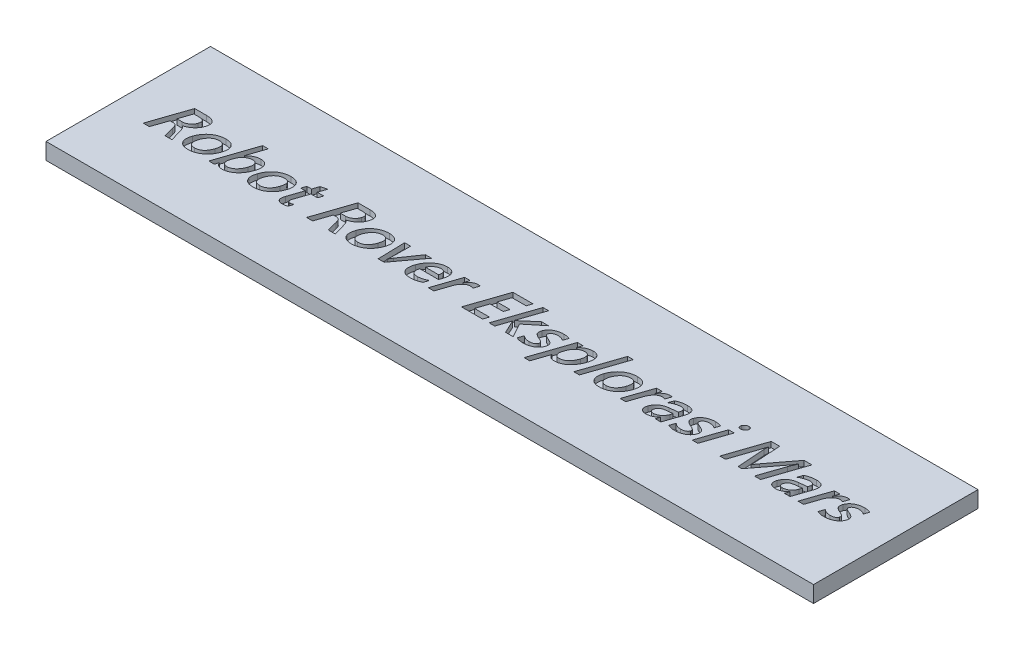
from build123d import *

# Parameters (mm, degrees)
SKETCH1_W           = 140
SKETCH1_H           = 30
BOSS_EXTRUDE1_DEPTH = 3
CUT_EXTRUDE1_DEPTH  = 1


with BuildPart() as part:
    # Sketch1 → Boss-Extrude1 (new body)
    with BuildSketch(Plane(origin=(0, 0, 0), x_dir=(1, 0, 0), z_dir=(0, 1, 0))):
        Rectangle(SKETCH1_W, SKETCH1_H)
    extrude(amount=BOSS_EXTRUDE1_DEPTH)

    # Sketch2 → Cut-Extrude1 (cut)
    # profile 1 of 25: a face of its own
    with BuildSketch(Plane(origin=(0, 3, 0), x_dir=(1, 0, 0), z_dir=(0, 1, 0))):
        with BuildLine():
            Line((-58.790447916, -3.243638249), (-60.070935721, -3.243638249))
            Line((-60.070935721, -3.243638249), (-60.528443343, -1.374926359))
            add(Edge.make_bspline(
                [(-60.528443343, -1.374926359), (-60.539716436, -1.330831844), (-60.561443637, -1.245846255), (-60.597314857, -1.124780195), (-60.634435657, -1.014594481), (-60.674255847, -0.91558983), (-60.716922882, -0.82750742), (-60.760925088, -0.749938771), (-60.805475306, -0.682262102), (-60.870064816, -0.609775151), (-60.959240899, -0.533502809), (-61.086955347, -0.470324244), (-61.232313616, -0.432330435), (-61.335173414, -0.428540118), (-61.388771087, -0.426565079)],
                knots=[0, 0, 0, 0, 1.162086897, 2.239748795, 3.223493175, 4.130048445, 4.962791981, 5.720403344, 6.406875973, 7.02633067, 8.195053693, 9.378081768, 10.633783868, 12, 12, 12, 12], degree=3))
            Line((-61.388771087, -0.426565079), (-61.951652185, -0.426565079))
            Line((-61.951652185, -0.426565079), (-62.909350355, -3.243638249))
            Line((-62.909350355, -3.243638249), (-64.019106453, -3.243638249))
            Line((-64.019106453, -3.243638249), (-61.639533282, 3.756361751))
            Line((-61.639533282, 3.756361751), (-59.444030233, 3.756361751))
            add(Edge.make_bspline(
                [(-59.444030233, 3.756361751), (-59.358167596, 3.754826184), (-59.192793659, 3.751868637), (-58.954639477, 3.729386729), (-58.736601469, 3.69174184), (-58.539246249, 3.636821421), (-58.361717693, 3.568438449), (-58.20493818, 3.482512646), (-58.068923488, 3.380426057), (-57.952735805, 3.263637968), (-57.8583991, 3.132392688), (-57.788391939, 2.986758398), (-57.740022119, 2.829015453), (-57.714736066, 2.658182788), (-57.715161069, 2.474900384), (-57.735152164, 2.278977614), (-57.78045043, 2.070291462), (-57.824496409, 1.92911758), (-57.847422002, 1.855637665)],
                knots=[0, 0, 0, 0, 1.332428083, 2.566295222, 3.70872949, 4.761809693, 5.740796898, 6.654994356, 7.527210903, 8.371352039, 9.202389497, 10.023309725, 10.86801475, 11.754123514, 12.69260855, 13.705375766, 14.805665813, 16, 16, 16, 16], degree=3))
            add(Edge.make_bspline(
                [(-57.847422002, 1.855637665), (-57.868329342, 1.797042208), (-57.910107117, 1.679954725), (-57.988116378, 1.511595389), (-58.075208615, 1.34889338), (-58.172565281, 1.192782738), (-58.280734922, 1.042921975), (-58.400395466, 0.9004891), (-58.527740036, 0.761938443), (-58.668145998, 0.633664036), (-58.8162669, 0.512525998), (-58.970575831, 0.398178555), (-59.133760613, 0.296414406), (-59.302509784, 0.202062953), (-59.478057273, 0.118289556), (-59.661072739, 0.045104884), (-59.849759644, -0.021294116), (-59.979971891, -0.055738662), (-60.045592733, -0.073097091)],
                knots=[0, 0, 0, 0, 0.97831671, 1.954906513, 2.915661747, 3.880279533, 4.847101179, 5.820604986, 6.805476196, 7.80536001, 8.80934573, 9.815254539, 10.824368433, 11.83258496, 12.855662828, 13.881796804, 14.932525306, 16, 16, 16, 16], degree=3))
            Line((-60.045592733, -0.073097091), (-60.052261941, -0.09043703))
            add(Edge.make_bspline(
                [(-60.052261941, -0.09043703), (-60.017652476, -0.106413305), (-59.945836944, -0.139564488), (-59.849389111, -0.219518127), (-59.757067119, -0.320782683), (-59.669230049, -0.446016375), (-59.586886923, -0.595167164), (-59.510317205, -0.768354692), (-59.436852641, -0.964791452), (-59.394309135, -1.105221575), (-59.372002794, -1.178851664)],
                knots=[0, 0, 0, 0, 0.689072993, 1.42984422, 2.251930149, 3.171846279, 4.197453122, 5.338391879, 6.604470059, 8, 8, 8, 8], degree=3))
            Line((-59.372002794, -1.178851664), (-58.790447916, -3.243638249))
        make_face()
        with BuildLine():
            Line((-60.849899136, 2.81733736), (-61.632864075, 0.512459312))
            Line((-61.632864075, 0.512459312), (-60.696507367, 0.512459312))
            add(Edge.make_bspline(
                [(-60.696507367, 0.512459312), (-60.648439652, 0.513442469), (-60.55336746, 0.515387038), (-60.412493431, 0.532201197), (-60.274800673, 0.558061763), (-60.141427649, 0.597683931), (-60.01140873, 0.645461607), (-59.8851473, 0.704104117), (-59.764103041, 0.776049596), (-59.645388534, 0.854787686), (-59.534637774, 0.944493917), (-59.430042213, 1.038174312), (-59.336238519, 1.140042569), (-59.249258523, 1.245507533), (-59.172973979, 1.359019917), (-59.104982968, 1.477455806), (-59.045645947, 1.601750874), (-59.014280667, 1.688180423), (-58.998527185, 1.731590409)],
                knots=[0, 0, 0, 0, 1.03415045, 2.045425865, 3.049431707, 4.045747411, 5.035794018, 6.028934023, 7.036626641, 8.063714019, 9.09187063, 10.101152132, 11.082839847, 12.069180136, 13.040553749, 14.022101546, 15.006583444, 16, 16, 16, 16], degree=3))
            add(Edge.make_bspline(
                [(-58.998527185, 1.731590409), (-58.984458877, 1.775398255), (-58.957586604, 1.859076867), (-58.930429636, 1.982709546), (-58.916881969, 2.097570849), (-58.915026015, 2.204036467), (-58.92511384, 2.302410351), (-58.948651839, 2.392878946), (-58.987505184, 2.474153129), (-59.036019562, 2.54874545), (-59.1014402, 2.612081396), (-59.177376711, 2.668324396), (-59.266585043, 2.715017543), (-59.36807436, 2.752138994), (-59.482071701, 2.781206952), (-59.608827703, 2.801850949), (-59.748286082, 2.815711547), (-59.845479674, 2.816779844), (-59.896202489, 2.81733736)],
                knots=[0, 0, 0, 0, 1.241487643, 2.371400871, 3.410471355, 4.358654217, 5.239998171, 6.072601514, 6.867232492, 7.66276924, 8.460475638, 9.31020196, 10.206776145, 11.167559245, 12.221288996, 13.377474728, 14.631372073, 16, 16, 16, 16], degree=3))
            Line((-59.896202489, 2.81733736), (-60.849899136, 2.81733736))
        make_face(mode=Mode.SUBTRACT)
    # profile 2 of 25: a face of its own
    with BuildSketch(Plane(origin=(0, 3, 0), x_dir=(1, 0, 0), z_dir=(0, 1, 0))):
        with BuildLine():
            add(Edge.make_bspline(
                [(-57.47261255, -0.812045262), (-57.437130132, -0.713665317), (-57.36694133, -0.519057093), (-57.238284322, -0.240639858), (-57.09344326, 0.022054849), (-56.934044147, 0.269725493), (-56.755179376, 0.500143279), (-56.560325256, 0.715086058), (-56.34886256, 0.914922001), (-56.12121177, 1.096491377), (-55.882071241, 1.260924145), (-55.631435701, 1.402710949), (-55.37248681, 1.5225019), (-55.105776218, 1.622501082), (-54.829729667, 1.698278441), (-54.545182058, 1.752536292), (-54.252248241, 1.787342178), (-54.054075009, 1.791065656), (-53.95393877, 1.792947116)],
                knots=[0, 0, 0, 0, 1.070068121, 2.116732827, 3.135146494, 4.138656866, 5.128117774, 6.117201857, 7.105531856, 8.102675928, 9.094812359, 10.073032377, 11.046275062, 12.012480686, 12.985180591, 13.972304958, 14.975412813, 16, 16, 16, 16], degree=3))
            add(Edge.make_bspline(
                [(-53.95393877, 1.792947116), (-53.861791888, 1.79110553), (-53.684015915, 1.787552617), (-53.428726289, 1.754714883), (-53.194585998, 1.70457212), (-52.983879117, 1.62918746), (-52.793986549, 1.534586561), (-52.627463202, 1.41627768), (-52.482618403, 1.277012797), (-52.360415391, 1.117764722), (-52.264485768, 0.938993113), (-52.193505187, 0.744965067), (-52.147247984, 0.535563402), (-52.131808266, 0.310350175), (-52.140327116, 0.070387081), (-52.174737413, -0.184502684), (-52.235011107, -0.454936989), (-52.293569593, -0.637297746), (-52.323984502, -0.732014774)],
                knots=[0, 0, 0, 0, 1.190018333, 2.295863547, 3.320222782, 4.277779294, 5.179533918, 6.053014247, 6.906197417, 7.766774928, 8.635576861, 9.517048942, 10.428630856, 11.396607447, 12.42546698, 13.52634732, 14.715200383, 16, 16, 16, 16], degree=3))
            add(Edge.make_bspline(
                [(-52.323984502, -0.732014774), (-52.359106183, -0.828586518), (-52.428510837, -1.019423861), (-52.554852336, -1.293554605), (-52.697168459, -1.553068637), (-52.858537818, -1.796907829), (-53.035493678, -2.026513343), (-53.230462115, -2.240947332), (-53.441005086, -2.441619693), (-53.66859552, -2.62468041), (-53.907752421, -2.789331358), (-54.155038079, -2.934602104), (-54.410410977, -3.056138096), (-54.673290631, -3.155316882), (-54.943240407, -3.232662262), (-55.220532227, -3.288978653), (-55.505218859, -3.323248187), (-55.697620039, -3.327074601), (-55.794639989, -3.329004103)],
                knots=[0, 0, 0, 0, 1.063808993, 2.102214111, 3.122328258, 4.126090526, 5.127198578, 6.121421553, 7.124549986, 8.13631694, 9.142736956, 10.129081552, 11.103238908, 12.067882887, 13.035555031, 14.008089689, 14.995562082, 16, 16, 16, 16], degree=3))
            add(Edge.make_bspline(
                [(-55.794639989, -3.329004103), (-55.887666255, -3.327132464), (-56.066754097, -3.323529313), (-56.324045805, -3.291228434), (-56.56010328, -3.23876337), (-56.774059476, -3.162671456), (-56.967183087, -3.066777552), (-57.138047811, -2.948155048), (-57.285394151, -2.8064623), (-57.412169766, -2.646083818), (-57.51190475, -2.46587679), (-57.587282023, -2.271186544), (-57.63532822, -2.061901361), (-57.656017673, -1.838674547), (-57.649952098, -1.601093013), (-57.616248719, -1.349523163), (-57.559494475, -1.083253352), (-57.502238027, -0.904523288), (-57.47261255, -0.812045262)],
                knots=[0, 0, 0, 0, 1.197876586, 2.306070563, 3.334191797, 4.306968694, 5.223922768, 6.104135836, 6.975076838, 7.848105595, 8.727591685, 9.617828025, 10.529184518, 11.484317795, 12.498303897, 13.58376941, 14.749800508, 16, 16, 16, 16], degree=3))
        make_face()
        with BuildLine():
            add(Edge.make_bspline(
                [(-56.356187246, -0.789369957), (-56.376466517, -0.853623898), (-56.415605051, -0.977632547), (-56.460532301, -1.16004439), (-56.486972474, -1.33193365), (-56.500579514, -1.492967897), (-56.49538556, -1.64383139), (-56.474140578, -1.78347331), (-56.438430082, -1.912734759), (-56.385083085, -2.030044973), (-56.31647149, -2.135125002), (-56.234068272, -2.227264909), (-56.137608275, -2.305518871), (-56.025671555, -2.366458674), (-55.902471437, -2.416700918), (-55.76494585, -2.450230294), (-55.614404896, -2.47239478), (-55.509286533, -2.474334696), (-55.454510416, -2.475345567)],
                knots=[0, 0, 0, 0, 1.371502821, 2.646969329, 3.819567038, 4.908749357, 5.932164107, 6.884553049, 7.778460756, 8.6533795, 9.496881695, 10.323708365, 11.160531277, 12.011527119, 12.909047513, 13.861780465, 14.885795399, 16, 16, 16, 16], degree=3))
            add(Edge.make_bspline(
                [(-55.454510416, -2.475345567), (-55.396211619, -2.474080584), (-55.281042697, -2.471581619), (-55.111868456, -2.451321888), (-54.949100398, -2.417615461), (-54.792692977, -2.371869084), (-54.643999059, -2.308948802), (-54.500640757, -2.236034897), (-54.363669842, -2.148866244), (-54.23477841, -2.047210516), (-54.112000237, -1.932598967), (-53.99672768, -1.804441082), (-53.886329063, -1.663664994), (-53.784068393, -1.508479354), (-53.688359376, -1.340259265), (-53.59848829, -1.159175169), (-53.515817986, -0.96446446), (-53.46769328, -0.828326287), (-53.443077489, -0.758691603)],
                knots=[0, 0, 0, 0, 0.981817553, 1.939574664, 2.864924639, 3.779544142, 4.67941848, 5.580445205, 6.486283566, 7.409175364, 8.341770785, 9.312066383, 10.309836133, 11.352576752, 12.439434165, 13.568164506, 14.756115997, 16, 16, 16, 16], degree=3))
            add(Edge.make_bspline(
                [(-53.443077489, -0.758691603), (-53.421329872, -0.691804533), (-53.379603988, -0.563472217), (-53.332873359, -0.373995009), (-53.300070573, -0.19725821), (-53.28336179, -0.032585996), (-53.282812686, 0.119834162), (-53.297941371, 0.260231837), (-53.330389185, 0.388374482), (-53.376373512, 0.504740268), (-53.440514327, 0.607292327), (-53.517911387, 0.697957429), (-53.612013076, 0.773290918), (-53.719786636, 0.835470627), (-53.843196968, 0.881195125), (-53.980252393, 0.916474945), (-54.13257954, 0.93565371), (-54.238887288, 0.938046537), (-54.294068343, 0.93928858)],
                knots=[0, 0, 0, 0, 1.427433999, 2.738734291, 3.95859159, 5.074070508, 6.094017578, 7.047925238, 7.932342938, 8.770408536, 9.576968482, 10.376834028, 11.178937248, 12.011883575, 12.891914828, 13.842014288, 14.87985653, 16, 16, 16, 16], degree=3))
            add(Edge.make_bspline(
                [(-54.294068343, 0.93928858), (-54.351510953, 0.938289294), (-54.465085257, 0.936313528), (-54.632300195, 0.912054975), (-54.794930267, 0.87653088), (-54.953001569, 0.825474804), (-55.106281439, 0.759781974), (-55.255928182, 0.680855656), (-55.399318484, 0.585524536), (-55.538484257, 0.477696491), (-55.669388602, 0.356138216), (-55.794642927, 0.225057071), (-55.910445713, 0.08222703), (-56.017069788, -0.071359717), (-56.114917587, -0.235691867), (-56.205187446, -0.409670527), (-56.287693383, -0.594653055), (-56.333074368, -0.72366381), (-56.356187246, -0.789369957)],
                knots=[0, 0, 0, 0, 0.956364266, 1.890903048, 2.809329927, 3.72769705, 4.653740921, 5.584985335, 6.542467938, 7.519019215, 8.51518331, 9.516046642, 10.537668258, 11.575465434, 12.628694995, 13.722113536, 14.839855301, 16, 16, 16, 16], degree=3))
        make_face(mode=Mode.SUBTRACT)
    # profile 3 of 25: a face of its own
    with BuildSketch(Plane(origin=(0, 3, 0), x_dir=(1, 0, 0), z_dir=(0, 1, 0))):
        with BuildLine():
            Line((-50.802071392, -2.534034591), (-51.043496697, -3.243638249))
            Line((-51.043496697, -3.243638249), (-52.067886941, -3.243638249))
            Line((-52.067886941, -3.243638249), (-49.572269563, 4.097825165))
            Line((-49.572269563, 4.097825165), (-48.547879319, 4.097825165))
            Line((-48.547879319, 4.097825165), (-49.654967733, 0.840584312))
            Line((-49.654967733, 0.840584312), (-49.632292428, 0.840584312))
            add(Edge.make_bspline(
                [(-49.632292428, 0.840584312), (-49.557621057, 0.916299354), (-49.411467644, 1.064495533), (-49.174046308, 1.25730867), (-48.931768249, 1.423684361), (-48.681870567, 1.558725949), (-48.425424265, 1.664449196), (-48.161514127, 1.737184508), (-47.891588184, 1.785019418), (-47.708650084, 1.790298335), (-47.616857977, 1.792947116)],
                knots=[0, 0, 0, 0, 1.111575005, 2.175672927, 3.193394731, 4.181792386, 5.141265875, 6.087986359, 7.04061668, 8, 8, 8, 8], degree=3))
            add(Edge.make_bspline(
                [(-47.616857977, 1.792947116), (-47.540718999, 1.790973178), (-47.394445729, 1.787180974), (-47.184981228, 1.756395175), (-46.994914149, 1.705998696), (-46.823450212, 1.635802718), (-46.672168777, 1.542849004), (-46.540999272, 1.429024116), (-46.428439885, 1.295398303), (-46.338413203, 1.140493203), (-46.267623045, 0.969649676), (-46.219330912, 0.782923474), (-46.195112704, 0.582115703), (-46.191701547, 0.367205498), (-46.209432813, 0.138130276), (-46.250789683, -0.104645455), (-46.312116011, -0.362431485), (-46.368455398, -0.536304489), (-46.39772688, -0.626641298)],
                knots=[0, 0, 0, 0, 1.098035838, 2.109475276, 3.046152957, 3.928852106, 4.772636432, 5.595687001, 6.424342125, 7.28128643, 8.169908476, 9.084697882, 10.054522633, 11.080982472, 12.180983686, 13.364129678, 14.630517044, 16, 16, 16, 16], degree=3))
            add(Edge.make_bspline(
                [(-46.39772688, -0.626641298), (-46.433327185, -0.726304157), (-46.503624084, -0.923099944), (-46.6303575, -1.205777859), (-46.768180827, -1.47480132), (-46.922736642, -1.727925073), (-47.090371595, -1.966563393), (-47.272020648, -2.19051184), (-47.469579353, -2.397763707), (-47.678344193, -2.59024594), (-47.897845798, -2.763108076), (-48.123332844, -2.91497047), (-48.35497361, -3.041770396), (-48.59113342, -3.147056706), (-48.832664246, -3.228723122), (-49.080171602, -3.286066263), (-49.332465354, -3.321854212), (-49.502793444, -3.326614878), (-49.58827566, -3.329004103)],
                knots=[0, 0, 0, 0, 1.137838431, 2.246792949, 3.329000113, 4.386942308, 5.433704784, 6.463597808, 7.485119528, 8.510606905, 9.515097085, 10.487253259, 11.431051939, 12.351620298, 13.264981702, 14.168564292, 15.080861048, 16, 16, 16, 16], degree=3))
            add(Edge.make_bspline(
                [(-49.58827566, -3.329004103), (-49.665360405, -3.327049947), (-49.81253257, -3.323319023), (-50.021950839, -3.28568623), (-50.208075617, -3.223493168), (-50.371821967, -3.136024628), (-50.511343979, -3.021961707), (-50.627997412, -2.883503995), (-50.720576468, -2.719220441), (-50.759346171, -2.597159119), (-50.779396087, -2.534034591)],
                knots=[0, 0, 0, 0, 1.187768738, 2.267718424, 3.267278759, 4.203001175, 5.114289305, 6.029052945, 6.980716416, 8, 8, 8, 8], degree=3))
            Line((-50.779396087, -2.534034591), (-50.802071392, -2.534034591))
        make_face()
        with BuildLine():
            add(Edge.make_bspline(
                [(-50.345897611, -1.165513249), (-50.360099957, -1.210191771), (-50.387652615, -1.296868437), (-50.413605069, -1.427001835), (-50.429916175, -1.551417835), (-50.429117371, -1.670904619), (-50.417835857, -1.785584993), (-50.392131563, -1.894718917), (-50.355102731, -1.999375323), (-50.302333365, -2.095822147), (-50.240656755, -2.185711663), (-50.166439016, -2.263492514), (-50.082977649, -2.329587457), (-49.989612928, -2.383648472), (-49.886169691, -2.424900702), (-49.773105451, -2.45349253), (-49.65121359, -2.473317551), (-49.566574667, -2.474655464), (-49.522917428, -2.475345567)],
                knots=[0, 0, 0, 0, 1.202462416, 2.332786098, 3.401570868, 4.417305982, 5.392812766, 6.353452148, 7.288532181, 8.233105655, 9.167140399, 10.079375762, 10.981272219, 11.891506437, 12.838833776, 13.82983943, 14.880618833, 16, 16, 16, 16], degree=3))
            add(Edge.make_bspline(
                [(-49.522917428, -2.475345567), (-49.468604295, -2.473702559), (-49.360840342, -2.470442629), (-49.201148248, -2.447502156), (-49.045604349, -2.407925221), (-48.893432625, -2.355681199), (-48.746978843, -2.284353873), (-48.603504239, -2.200648118), (-48.464950581, -2.099672251), (-48.329950128, -1.984976603), (-48.20163055, -1.855980127), (-48.079732985, -1.715000267), (-47.964298863, -1.562746201), (-47.85881252, -1.397380279), (-47.758944958, -1.221325996), (-47.667623178, -1.032999249), (-47.581739086, -0.83342858), (-47.532493898, -0.694522175), (-47.507482977, -0.623973615)],
                knots=[0, 0, 0, 0, 0.890826747, 1.7675101, 2.639539838, 3.52064098, 4.401410046, 5.306981778, 6.242113848, 7.209563012, 8.210013427, 9.223352964, 10.26480374, 11.34101589, 12.438297933, 13.583143253, 14.772513305, 16, 16, 16, 16], degree=3))
            add(Edge.make_bspline(
                [(-47.507482977, -0.623973615), (-47.488566099, -0.565044859), (-47.452012532, -0.451175324), (-47.410323395, -0.283314321), (-47.383391207, -0.125002382), (-47.369157438, 0.023501138), (-47.369923222, 0.162605227), (-47.385966734, 0.291931884), (-47.415192697, 0.411608172), (-47.457406419, 0.521518166), (-47.513908838, 0.620197099), (-47.58365857, 0.706356041), (-47.666018718, 0.778837437), (-47.760023262, 0.839279933), (-47.867306131, 0.883723514), (-47.986208407, 0.915383562), (-48.116783628, 0.93601843), (-48.208110532, 0.938167251), (-48.255768038, 0.93928858)],
                knots=[0, 0, 0, 0, 1.397076023, 2.699605573, 3.901004902, 5.01975609, 6.06377567, 7.034940963, 7.955229659, 8.838818118, 9.684233623, 10.512003628, 11.329792389, 12.151269332, 13.023841193, 13.939464611, 14.924742076, 16, 16, 16, 16], degree=3))
            add(Edge.make_bspline(
                [(-48.255768038, 0.93928858), (-48.304750651, 0.93804275), (-48.402677483, 0.935552066), (-48.54846576, 0.914203115), (-48.692856419, 0.882909541), (-48.83510624, 0.836796846), (-48.975322537, 0.778149624), (-49.113413777, 0.70542451), (-49.249229592, 0.619419526), (-49.383299798, 0.523347942), (-49.51006877, 0.415516746), (-49.630043648, 0.300610129), (-49.739046997, 0.176767448), (-49.837666734, 0.044877043), (-49.929774923, -0.092439495), (-50.009027553, -0.239336906), (-50.078976575, -0.393765327), (-50.118039471, -0.500546779), (-50.137818343, -0.554613859)],
                knots=[0, 0, 0, 0, 0.918660452, 1.836600847, 2.759607552, 3.688327661, 4.638130367, 5.608378429, 6.612989935, 7.652670378, 8.700586109, 9.733112125, 10.767523912, 11.792030647, 12.821721531, 13.867076946, 14.920028532, 16, 16, 16, 16], degree=3))
            Line((-50.137818343, -0.554613859), (-50.345897611, -1.165513249))
        make_face(mode=Mode.SUBTRACT)
    # profile 4 of 25: a face of its own
    with BuildSketch(Plane(origin=(0, 3, 0), x_dir=(1, 0, 0), z_dir=(0, 1, 0))):
        with BuildLine():
            add(Edge.make_bspline(
                [(-45.606758892, -0.812045262), (-45.571276473, -0.713665317), (-45.501087671, -0.519057093), (-45.372430663, -0.240639858), (-45.227589601, 0.022054849), (-45.068190488, 0.269725493), (-44.889325717, 0.500143279), (-44.694471598, 0.715086058), (-44.483008902, 0.914922001), (-44.255358112, 1.096491377), (-44.016217582, 1.260924145), (-43.765582042, 1.402710949), (-43.506633152, 1.5225019), (-43.23992256, 1.622501082), (-42.963876009, 1.698278441), (-42.679328399, 1.752536292), (-42.386394583, 1.787342178), (-42.18822135, 1.791065656), (-42.088085111, 1.792947116)],
                knots=[0, 0, 0, 0, 1.070068121, 2.116732827, 3.135146494, 4.138656866, 5.128117774, 6.117201857, 7.105531856, 8.102675928, 9.094812359, 10.073032377, 11.046275062, 12.012480686, 12.985180591, 13.972304958, 14.975412813, 16, 16, 16, 16], degree=3))
            add(Edge.make_bspline(
                [(-42.088085111, 1.792947116), (-41.995938229, 1.79110553), (-41.818162256, 1.787552617), (-41.562872631, 1.754714883), (-41.328732339, 1.70457212), (-41.118025459, 1.62918746), (-40.92813289, 1.534586561), (-40.761609543, 1.41627768), (-40.616764744, 1.277012797), (-40.494561733, 1.117764722), (-40.39863211, 0.938993113), (-40.327651529, 0.744965067), (-40.281394326, 0.535563402), (-40.265954607, 0.310350175), (-40.274473458, 0.070387081), (-40.308883755, -0.184502684), (-40.369157448, -0.454936989), (-40.427715934, -0.637297746), (-40.458130843, -0.732014774)],
                knots=[0, 0, 0, 0, 1.190018333, 2.295863547, 3.320222782, 4.277779294, 5.179533918, 6.053014247, 6.906197417, 7.766774928, 8.635576861, 9.517048942, 10.428630856, 11.396607447, 12.42546698, 13.52634732, 14.715200383, 16, 16, 16, 16], degree=3))
            add(Edge.make_bspline(
                [(-40.458130843, -0.732014774), (-40.493252525, -0.828586518), (-40.562657178, -1.019423861), (-40.688998677, -1.293554605), (-40.8313148, -1.553068637), (-40.992684159, -1.796907829), (-41.169640019, -2.026513343), (-41.364608457, -2.240947332), (-41.575151428, -2.441619693), (-41.802741861, -2.62468041), (-42.041898763, -2.789331358), (-42.28918442, -2.934602104), (-42.544557318, -3.056138096), (-42.807436972, -3.155316882), (-43.077386749, -3.232662262), (-43.354678569, -3.288978653), (-43.6393652, -3.323248187), (-43.83176638, -3.327074601), (-43.928786331, -3.329004103)],
                knots=[0, 0, 0, 0, 1.063808993, 2.102214111, 3.122328258, 4.126090526, 5.127198578, 6.121421553, 7.124549986, 8.13631694, 9.142736956, 10.129081552, 11.103238908, 12.067882887, 13.035555031, 14.008089689, 14.995562082, 16, 16, 16, 16], degree=3))
            add(Edge.make_bspline(
                [(-43.928786331, -3.329004103), (-44.021812597, -3.327132464), (-44.200900439, -3.323529313), (-44.458192147, -3.291228434), (-44.694249621, -3.23876337), (-44.908205818, -3.162671456), (-45.101329429, -3.066777552), (-45.272194153, -2.948155048), (-45.419540492, -2.8064623), (-45.546316107, -2.646083818), (-45.646051092, -2.46587679), (-45.721428365, -2.271186544), (-45.769474562, -2.061901361), (-45.790164015, -1.838674547), (-45.784098439, -1.601093013), (-45.75039506, -1.349523163), (-45.693640816, -1.083253352), (-45.636384368, -0.904523288), (-45.606758892, -0.812045262)],
                knots=[0, 0, 0, 0, 1.197876586, 2.306070563, 3.334191797, 4.306968694, 5.223922768, 6.104135836, 6.975076838, 7.848105595, 8.727591685, 9.617828025, 10.529184518, 11.484317795, 12.498303897, 13.58376941, 14.749800508, 16, 16, 16, 16], degree=3))
        make_face()
        with BuildLine():
            add(Edge.make_bspline(
                [(-44.490333587, -0.789369957), (-44.510612858, -0.853623898), (-44.549751392, -0.977632547), (-44.594678643, -1.16004439), (-44.621118816, -1.33193365), (-44.634725855, -1.492967897), (-44.629531901, -1.64383139), (-44.60828692, -1.78347331), (-44.572576424, -1.912734759), (-44.519229426, -2.030044973), (-44.450617831, -2.135125002), (-44.368214614, -2.227264909), (-44.271754617, -2.305518871), (-44.159817897, -2.366458674), (-44.036617779, -2.416700918), (-43.899092192, -2.450230294), (-43.748551238, -2.47239478), (-43.643432875, -2.474334696), (-43.588656758, -2.475345567)],
                knots=[0, 0, 0, 0, 1.371502821, 2.646969329, 3.819567038, 4.908749357, 5.932164107, 6.884553049, 7.778460756, 8.6533795, 9.496881695, 10.323708365, 11.160531277, 12.011527119, 12.909047513, 13.861780465, 14.885795399, 16, 16, 16, 16], degree=3))
            add(Edge.make_bspline(
                [(-43.588656758, -2.475345567), (-43.530357961, -2.474080584), (-43.415189039, -2.471581619), (-43.246014798, -2.451321888), (-43.083246739, -2.417615461), (-42.926839318, -2.371869084), (-42.778145401, -2.308948802), (-42.634787099, -2.236034897), (-42.497816184, -2.148866244), (-42.368924751, -2.047210516), (-42.246146578, -1.932598967), (-42.130874021, -1.804441082), (-42.020475404, -1.663664994), (-41.918214734, -1.508479354), (-41.822505718, -1.340259265), (-41.732634632, -1.159175169), (-41.649964327, -0.96446446), (-41.601839621, -0.828326287), (-41.577223831, -0.758691603)],
                knots=[0, 0, 0, 0, 0.981817553, 1.939574664, 2.864924639, 3.779544142, 4.67941848, 5.580445205, 6.486283566, 7.409175364, 8.341770785, 9.312066383, 10.309836133, 11.352576752, 12.439434165, 13.568164506, 14.756115997, 16, 16, 16, 16], degree=3))
            add(Edge.make_bspline(
                [(-41.577223831, -0.758691603), (-41.555476214, -0.691804533), (-41.51375033, -0.563472217), (-41.4670197, -0.373995009), (-41.434216914, -0.19725821), (-41.417508132, -0.032585996), (-41.416959027, 0.119834162), (-41.432087713, 0.260231837), (-41.464535526, 0.388374482), (-41.510519853, 0.504740268), (-41.574660669, 0.607292327), (-41.652057729, 0.697957429), (-41.746159417, 0.773290918), (-41.853932978, 0.835470627), (-41.977343309, 0.881195125), (-42.114398734, 0.916474945), (-42.266725881, 0.93565371), (-42.373033629, 0.938046537), (-42.428214685, 0.93928858)],
                knots=[0, 0, 0, 0, 1.427433999, 2.738734291, 3.95859159, 5.074070508, 6.094017578, 7.047925238, 7.932342938, 8.770408536, 9.576968482, 10.376834028, 11.178937248, 12.011883575, 12.891914828, 13.842014288, 14.87985653, 16, 16, 16, 16], degree=3))
            add(Edge.make_bspline(
                [(-42.428214685, 0.93928858), (-42.485657295, 0.938289294), (-42.599231599, 0.936313528), (-42.766446536, 0.912054975), (-42.929076608, 0.87653088), (-43.087147911, 0.825474804), (-43.24042778, 0.759781974), (-43.390074524, 0.680855656), (-43.533464825, 0.585524536), (-43.672630598, 0.477696491), (-43.803534944, 0.356138216), (-43.928789268, 0.225057071), (-44.044592054, 0.08222703), (-44.151216129, -0.071359717), (-44.249063929, -0.235691867), (-44.339333787, -0.409670527), (-44.421839724, -0.594653055), (-44.46722071, -0.72366381), (-44.490333587, -0.789369957)],
                knots=[0, 0, 0, 0, 0.956364266, 1.890903048, 2.809329927, 3.72769705, 4.653740921, 5.584985335, 6.542467938, 7.519019215, 8.51518331, 9.516046642, 10.537668258, 11.575465434, 12.628694995, 13.722113536, 14.839855301, 16, 16, 16, 16], degree=3))
        make_face(mode=Mode.SUBTRACT)
    # profile 5 of 25: a face of its own
    with BuildSketch(Plane(origin=(0, 3, 0), x_dir=(1, 0, 0), z_dir=(0, 1, 0))):
        with BuildLine():
            add(Edge.make_bspline(
                [(-37.690409807, -3.136930932), (-37.752342378, -3.166886074), (-37.880157184, -3.228706704), (-38.094474474, -3.286338924), (-38.330694533, -3.323029583), (-38.496336061, -3.326955821), (-38.582749746, -3.329004103)],
                knots=[0, 0, 0, 0, 0.893995491, 1.845004286, 2.875758254, 4, 4, 4, 4], degree=3))
            add(Edge.make_bspline(
                [(-38.582749746, -3.329004103), (-38.638392678, -3.328332808), (-38.745137042, -3.327045009), (-38.897257561, -3.307657161), (-39.035100238, -3.278964889), (-39.158229697, -3.238288224), (-39.266784651, -3.184707484), (-39.359573795, -3.118634413), (-39.439482554, -3.042135895), (-39.500253188, -2.950610652), (-39.549894315, -2.849731397), (-39.580606203, -2.735606925), (-39.599796067, -2.610812008), (-39.601618092, -2.473659562), (-39.586933689, -2.325211093), (-39.560044009, -2.164728816), (-39.518946675, -1.992424354), (-39.480434478, -1.875741152), (-39.460417428, -1.815094042)],
                knots=[0, 0, 0, 0, 1.209809078, 2.320875193, 3.330264354, 4.269393374, 5.1346194, 5.953275947, 6.739930105, 7.526108296, 8.330873158, 9.175964714, 10.085738669, 11.072627475, 12.150736948, 13.327571576, 14.61098208, 16, 16, 16, 16], degree=3))
            Line((-39.460417428, -1.815094042), (-38.553405233, 0.853922726))
            Line((-38.553405233, 0.853922726), (-39.40706377, 0.853922726))
            Line((-39.40706377, 0.853922726), (-39.116286331, 1.707581263))
            Line((-39.116286331, 1.707581263), (-38.262627794, 1.707581263))
            Line((-38.262627794, 1.707581263), (-37.87581377, 2.846681872))
            Line((-37.87581377, 2.846681872), (-36.74605005, 3.158800775))
            Line((-36.74605005, 3.158800775), (-37.23823755, 1.707581263))
            Line((-37.23823755, 1.707581263), (-36.043115599, 1.707581263))
            Line((-36.043115599, 1.707581263), (-36.333893038, 0.853922726))
            Line((-36.333893038, 0.853922726), (-37.529014989, 0.853922726))
            Line((-37.529014989, 0.853922726), (-38.369335111, -1.617685506))
            add(Edge.make_bspline(
                [(-38.369335111, -1.617685506), (-38.381249532, -1.654031998), (-38.404048509, -1.723583248), (-38.431264867, -1.82547971), (-38.449240223, -1.919642593), (-38.462919816, -2.005844648), (-38.46508919, -2.084146873), (-38.461291895, -2.154670518), (-38.451796853, -2.217986671), (-38.431550397, -2.273605537), (-38.402529853, -2.321641917), (-38.366269773, -2.363503126), (-38.321160475, -2.399079807), (-38.266824765, -2.426403953), (-38.205217846, -2.449400615), (-38.135225902, -2.464930417), (-38.057034327, -2.47436028), (-38.002114418, -2.47500562), (-37.973184197, -2.475345567)],
                knots=[0, 0, 0, 0, 1.530941346, 2.929550401, 4.217455846, 5.367659994, 6.418276171, 7.345250248, 8.193731811, 8.970701614, 9.697108899, 10.4287297, 11.176408466, 11.980423546, 12.853194396, 13.802951793, 14.842658478, 16, 16, 16, 16], degree=3))
            add(Edge.make_bspline(
                [(-37.973184197, -2.475345567), (-37.925827244, -2.472972812), (-37.829344893, -2.468138697), (-37.685148203, -2.429464293), (-37.539485215, -2.369355731), (-37.447374588, -2.312659066), (-37.399632367, -2.283272396)],
                knots=[0, 0, 0, 0, 0.925795898, 1.886163673, 2.904369213, 4, 4, 4, 4], degree=3))
            Line((-37.399632367, -2.283272396), (-37.690409807, -3.136930932))
        make_face()
    # profile 6 of 25: a face of its own
    with BuildSketch(Plane(origin=(0, 3, 0), x_dir=(1, 0, 0), z_dir=(0, 1, 0))):
        with BuildLine():
            Line((-28.997764989, -3.243638249), (-30.278252794, -3.243638249))
            Line((-30.278252794, -3.243638249), (-30.735760416, -1.374926359))
            add(Edge.make_bspline(
                [(-30.735760416, -1.374926359), (-30.747033509, -1.330831844), (-30.76876071, -1.245846255), (-30.80463193, -1.124780195), (-30.84175273, -1.014594481), (-30.88157292, -0.91558983), (-30.924239955, -0.82750742), (-30.968242161, -0.749938771), (-31.012792379, -0.682262102), (-31.077381889, -0.609775151), (-31.166557972, -0.533502809), (-31.29427242, -0.470324244), (-31.43963069, -0.432330435), (-31.542490487, -0.428540118), (-31.59608816, -0.426565079)],
                knots=[0, 0, 0, 0, 1.162086897, 2.239748795, 3.223493175, 4.130048445, 4.962791981, 5.720403344, 6.406875973, 7.02633067, 8.195053693, 9.378081768, 10.633783868, 12, 12, 12, 12], degree=3))
            Line((-31.59608816, -0.426565079), (-32.158969258, -0.426565079))
            Line((-32.158969258, -0.426565079), (-33.116667428, -3.243638249))
            Line((-33.116667428, -3.243638249), (-34.226423526, -3.243638249))
            Line((-34.226423526, -3.243638249), (-31.846850355, 3.756361751))
            Line((-31.846850355, 3.756361751), (-29.651347307, 3.756361751))
            add(Edge.make_bspline(
                [(-29.651347307, 3.756361751), (-29.565484669, 3.754826184), (-29.400110732, 3.751868637), (-29.16195655, 3.729386729), (-28.943918542, 3.69174184), (-28.746563322, 3.636821421), (-28.569034766, 3.568438449), (-28.412255253, 3.482512646), (-28.276240561, 3.380426057), (-28.160052878, 3.263637968), (-28.065716173, 3.132392688), (-27.995709012, 2.986758398), (-27.947339192, 2.829015453), (-27.922053139, 2.658182788), (-27.922478142, 2.474900384), (-27.942469237, 2.278977614), (-27.987767503, 2.070291462), (-28.031813483, 1.92911758), (-28.054739075, 1.855637665)],
                knots=[0, 0, 0, 0, 1.332428083, 2.566295222, 3.70872949, 4.761809693, 5.740796898, 6.654994356, 7.527210903, 8.371352039, 9.202389497, 10.023309725, 10.86801475, 11.754123514, 12.69260855, 13.705375766, 14.805665813, 16, 16, 16, 16], degree=3))
            add(Edge.make_bspline(
                [(-28.054739075, 1.855637665), (-28.075646415, 1.797042208), (-28.11742419, 1.679954725), (-28.195433451, 1.511595389), (-28.282525688, 1.34889338), (-28.379882355, 1.192782738), (-28.488051995, 1.042921975), (-28.607712539, 0.9004891), (-28.735057109, 0.761938443), (-28.875463071, 0.633664036), (-29.023583973, 0.512525998), (-29.177892904, 0.398178555), (-29.341077687, 0.296414406), (-29.509826857, 0.202062953), (-29.685374346, 0.118289556), (-29.868389812, 0.045104884), (-30.057076718, -0.021294116), (-30.187288964, -0.055738662), (-30.252909807, -0.073097091)],
                knots=[0, 0, 0, 0, 0.97831671, 1.954906513, 2.915661747, 3.880279533, 4.847101179, 5.820604986, 6.805476196, 7.80536001, 8.80934573, 9.815254539, 10.824368433, 11.83258496, 12.855662828, 13.881796804, 14.932525306, 16, 16, 16, 16], degree=3))
            Line((-30.252909807, -0.073097091), (-30.259579014, -0.09043703))
            add(Edge.make_bspline(
                [(-30.259579014, -0.09043703), (-30.224969549, -0.106413305), (-30.153154017, -0.139564488), (-30.056706185, -0.219518127), (-29.964384192, -0.320782683), (-29.876547122, -0.446016375), (-29.794203996, -0.595167164), (-29.717634279, -0.768354692), (-29.644169714, -0.964791452), (-29.601626208, -1.105221575), (-29.579319867, -1.178851664)],
                knots=[0, 0, 0, 0, 0.689072993, 1.42984422, 2.251930149, 3.171846279, 4.197453122, 5.338391879, 6.604470059, 8, 8, 8, 8], degree=3))
            Line((-29.579319867, -1.178851664), (-28.997764989, -3.243638249))
        make_face()
        with BuildLine():
            Line((-31.057216209, 2.81733736), (-31.840181148, 0.512459312))
            Line((-31.840181148, 0.512459312), (-30.903824441, 0.512459312))
            add(Edge.make_bspline(
                [(-30.903824441, 0.512459312), (-30.855756725, 0.513442469), (-30.760684533, 0.515387038), (-30.619810504, 0.532201197), (-30.482117746, 0.558061763), (-30.348744723, 0.597683931), (-30.218725803, 0.645461607), (-30.092464373, 0.704104117), (-29.971420114, 0.776049596), (-29.852705607, 0.854787686), (-29.741954847, 0.944493917), (-29.637359286, 1.038174312), (-29.543555592, 1.140042569), (-29.456575596, 1.245507533), (-29.380291052, 1.359019917), (-29.312300041, 1.477455806), (-29.252963021, 1.601750874), (-29.22159774, 1.688180423), (-29.205844258, 1.731590409)],
                knots=[0, 0, 0, 0, 1.03415045, 2.045425865, 3.049431707, 4.045747411, 5.035794018, 6.028934023, 7.036626641, 8.063714019, 9.09187063, 10.101152132, 11.082839847, 12.069180136, 13.040553749, 14.022101546, 15.006583444, 16, 16, 16, 16], degree=3))
            add(Edge.make_bspline(
                [(-29.205844258, 1.731590409), (-29.191775951, 1.775398255), (-29.164903677, 1.859076867), (-29.137746709, 1.982709546), (-29.124199042, 2.097570849), (-29.122343089, 2.204036467), (-29.132430913, 2.302410351), (-29.155968912, 2.392878946), (-29.194822258, 2.474153129), (-29.243336635, 2.54874545), (-29.308757274, 2.612081396), (-29.384693785, 2.668324396), (-29.473902116, 2.715017543), (-29.575391433, 2.752138994), (-29.689388774, 2.781206952), (-29.816144776, 2.801850949), (-29.955603155, 2.815711547), (-30.052796747, 2.816779844), (-30.103519563, 2.81733736)],
                knots=[0, 0, 0, 0, 1.241487643, 2.371400871, 3.410471355, 4.358654217, 5.239998171, 6.072601514, 6.867232492, 7.66276924, 8.460475638, 9.31020196, 10.206776145, 11.167559245, 12.221288996, 13.377474728, 14.631372073, 16, 16, 16, 16], degree=3))
            Line((-30.103519563, 2.81733736), (-31.057216209, 2.81733736))
        make_face(mode=Mode.SUBTRACT)
    # profile 7 of 25: a face of its own
    with BuildSketch(Plane(origin=(0, 3, 0), x_dir=(1, 0, 0), z_dir=(0, 1, 0))):
        with BuildLine():
            add(Edge.make_bspline(
                [(-27.679929624, -0.812045262), (-27.644447205, -0.713665317), (-27.574258403, -0.519057093), (-27.445601395, -0.240639858), (-27.300760333, 0.022054849), (-27.14136122, 0.269725493), (-26.962496449, 0.500143279), (-26.767642329, 0.715086058), (-26.556179633, 0.914922001), (-26.328528844, 1.096491377), (-26.089388314, 1.260924145), (-25.838752774, 1.402710949), (-25.579803884, 1.5225019), (-25.313093291, 1.622501082), (-25.03704674, 1.698278441), (-24.752499131, 1.752536292), (-24.459565315, 1.787342178), (-24.261392082, 1.791065656), (-24.161255843, 1.792947116)],
                knots=[0, 0, 0, 0, 1.070068121, 2.116732827, 3.135146494, 4.138656866, 5.128117774, 6.117201857, 7.105531856, 8.102675928, 9.094812359, 10.073032377, 11.046275062, 12.012480686, 12.985180591, 13.972304958, 14.975412813, 16, 16, 16, 16], degree=3))
            add(Edge.make_bspline(
                [(-24.161255843, 1.792947116), (-24.069108961, 1.79110553), (-23.891332988, 1.787552617), (-23.636043362, 1.754714883), (-23.401903071, 1.70457212), (-23.19119619, 1.62918746), (-23.001303622, 1.534586561), (-22.834780275, 1.41627768), (-22.689935476, 1.277012797), (-22.567732465, 1.117764722), (-22.471802841, 0.938993113), (-22.400822261, 0.744965067), (-22.354565058, 0.535563402), (-22.339125339, 0.310350175), (-22.34764419, 0.070387081), (-22.382054486, -0.184502684), (-22.44232818, -0.454936989), (-22.500886666, -0.637297746), (-22.531301575, -0.732014774)],
                knots=[0, 0, 0, 0, 1.190018333, 2.295863547, 3.320222782, 4.277779294, 5.179533918, 6.053014247, 6.906197417, 7.766774928, 8.635576861, 9.517048942, 10.428630856, 11.396607447, 12.42546698, 13.52634732, 14.715200383, 16, 16, 16, 16], degree=3))
            add(Edge.make_bspline(
                [(-22.531301575, -0.732014774), (-22.566423256, -0.828586518), (-22.63582791, -1.019423861), (-22.762169409, -1.293554605), (-22.904485532, -1.553068637), (-23.065854891, -1.796907829), (-23.242810751, -2.026513343), (-23.437779188, -2.240947332), (-23.648322159, -2.441619693), (-23.875912593, -2.62468041), (-24.115069494, -2.789331358), (-24.362355152, -2.934602104), (-24.61772805, -3.056138096), (-24.880607704, -3.155316882), (-25.15055748, -3.232662262), (-25.427849301, -3.288978653), (-25.712535932, -3.323248187), (-25.904937112, -3.327074601), (-26.001957063, -3.329004103)],
                knots=[0, 0, 0, 0, 1.063808993, 2.102214111, 3.122328258, 4.126090526, 5.127198578, 6.121421553, 7.124549986, 8.13631694, 9.142736956, 10.129081552, 11.103238908, 12.067882887, 13.035555031, 14.008089689, 14.995562082, 16, 16, 16, 16], degree=3))
            add(Edge.make_bspline(
                [(-26.001957063, -3.329004103), (-26.094983328, -3.327132464), (-26.274071171, -3.323529313), (-26.531362879, -3.291228434), (-26.767420353, -3.23876337), (-26.98137655, -3.162671456), (-27.17450016, -3.066777552), (-27.345364884, -2.948155048), (-27.492711224, -2.8064623), (-27.619486839, -2.646083818), (-27.719221823, -2.46587679), (-27.794599096, -2.271186544), (-27.842645293, -2.061901361), (-27.863334747, -1.838674547), (-27.857269171, -1.601093013), (-27.823565792, -1.349523163), (-27.766811548, -1.083253352), (-27.7095551, -0.904523288), (-27.679929624, -0.812045262)],
                knots=[0, 0, 0, 0, 1.197876586, 2.306070563, 3.334191797, 4.306968694, 5.223922768, 6.104135836, 6.975076838, 7.848105595, 8.727591685, 9.617828025, 10.529184518, 11.484317795, 12.498303897, 13.58376941, 14.749800508, 16, 16, 16, 16], degree=3))
        make_face()
        with BuildLine():
            add(Edge.make_bspline(
                [(-26.563504319, -0.789369957), (-26.58378359, -0.853623898), (-26.622922124, -0.977632547), (-26.667849374, -1.16004439), (-26.694289547, -1.33193365), (-26.707896587, -1.492967897), (-26.702702633, -1.64383139), (-26.681457652, -1.78347331), (-26.645747156, -1.912734759), (-26.592400158, -2.030044973), (-26.523788563, -2.135125002), (-26.441385346, -2.227264909), (-26.344925349, -2.305518871), (-26.232988628, -2.366458674), (-26.10978851, -2.416700918), (-25.972262923, -2.450230294), (-25.82172197, -2.47239478), (-25.716603607, -2.474334696), (-25.661827489, -2.475345567)],
                knots=[0, 0, 0, 0, 1.371502821, 2.646969329, 3.819567038, 4.908749357, 5.932164107, 6.884553049, 7.778460756, 8.6533795, 9.496881695, 10.323708365, 11.160531277, 12.011527119, 12.909047513, 13.861780465, 14.885795399, 16, 16, 16, 16], degree=3))
            add(Edge.make_bspline(
                [(-25.661827489, -2.475345567), (-25.603528693, -2.474080584), (-25.488359771, -2.471581619), (-25.319185529, -2.451321888), (-25.156417471, -2.417615461), (-25.00001005, -2.371869084), (-24.851316133, -2.308948802), (-24.70795783, -2.236034897), (-24.570986916, -2.148866244), (-24.442095483, -2.047210516), (-24.31931731, -1.932598967), (-24.204044753, -1.804441082), (-24.093646136, -1.663664994), (-23.991385466, -1.508479354), (-23.895676449, -1.340259265), (-23.805805364, -1.159175169), (-23.723135059, -0.96446446), (-23.675010353, -0.828326287), (-23.650394563, -0.758691603)],
                knots=[0, 0, 0, 0, 0.981817553, 1.939574664, 2.864924639, 3.779544142, 4.67941848, 5.580445205, 6.486283566, 7.409175364, 8.341770785, 9.312066383, 10.309836133, 11.352576752, 12.439434165, 13.568164506, 14.756115997, 16, 16, 16, 16], degree=3))
            add(Edge.make_bspline(
                [(-23.650394563, -0.758691603), (-23.628646945, -0.691804533), (-23.586921061, -0.563472217), (-23.540190432, -0.373995009), (-23.507387646, -0.19725821), (-23.490678863, -0.032585996), (-23.490129759, 0.119834162), (-23.505258445, 0.260231837), (-23.537706258, 0.388374482), (-23.583690585, 0.504740268), (-23.6478314, 0.607292327), (-23.72522846, 0.697957429), (-23.819330149, 0.773290918), (-23.92710371, 0.835470627), (-24.050514041, 0.881195125), (-24.187569466, 0.916474945), (-24.339896613, 0.93565371), (-24.446204361, 0.938046537), (-24.501385416, 0.93928858)],
                knots=[0, 0, 0, 0, 1.427433999, 2.738734291, 3.95859159, 5.074070508, 6.094017578, 7.047925238, 7.932342938, 8.770408536, 9.576968482, 10.376834028, 11.178937248, 12.011883575, 12.891914828, 13.842014288, 14.87985653, 16, 16, 16, 16], degree=3))
            add(Edge.make_bspline(
                [(-24.501385416, 0.93928858), (-24.558828026, 0.938289294), (-24.672402331, 0.936313528), (-24.839617268, 0.912054975), (-25.00224734, 0.87653088), (-25.160318642, 0.825474804), (-25.313598512, 0.759781974), (-25.463245255, 0.680855656), (-25.606635557, 0.585524536), (-25.74580133, 0.477696491), (-25.876705676, 0.356138216), (-26.00196, 0.225057071), (-26.117762786, 0.08222703), (-26.224386861, -0.071359717), (-26.322234661, -0.235691867), (-26.412504519, -0.409670527), (-26.495010456, -0.594653055), (-26.540391442, -0.72366381), (-26.563504319, -0.789369957)],
                knots=[0, 0, 0, 0, 0.956364266, 1.890903048, 2.809329927, 3.72769705, 4.653740921, 5.584985335, 6.542467938, 7.519019215, 8.51518331, 9.516046642, 10.537668258, 11.575465434, 12.628694995, 13.722113536, 14.839855301, 16, 16, 16, 16], degree=3))
        make_face(mode=Mode.SUBTRACT)
    # profile 8 of 25: a face of its own
    with BuildSketch(Plane(origin=(0, 3, 0), x_dir=(1, 0, 0), z_dir=(0, 1, 0))):
        with BuildLine():
            Line((-16.387627794, 1.707581263), (-20.055691819, -3.243638249))
            Line((-20.055691819, -3.243638249), (-21.165447916, -3.243638249))
            Line((-21.165447916, -3.243638249), (-21.29616438, 1.707581263))
            Line((-21.29616438, 1.707581263), (-20.186408282, 1.707581263))
            Line((-20.186408282, 1.707581263), (-20.23042505, -1.715055932))
            add(Edge.make_bspline(
                [(-20.23042505, -1.715055932), (-20.23189303, -1.78622939), (-20.234722681, -1.923422118), (-20.251010236, -2.121541407), (-20.275374366, -2.304273825), (-20.299985496, -2.419892862), (-20.31178938, -2.475345567)],
                knots=[0, 0, 0, 0, 1.114846064, 2.14895804, 3.112211223, 4, 4, 4, 4], degree=3))
            Line((-20.31178938, -2.475345567), (-20.289114075, -2.475345567))
            add(Edge.make_bspline(
                [(-20.289114075, -2.475345567), (-20.228439462, -2.350793385), (-20.104374736, -2.096114671), (-19.949447156, -1.858922915), (-19.870287855, -1.737731237)],
                knots=[0, 0, 0, 0, 0.978112221, 2, 2, 2, 2], degree=3))
            Line((-19.870287855, -1.737731237), (-17.497383892, 1.707581263))
            Line((-17.497383892, 1.707581263), (-16.387627794, 1.707581263))
        make_face()
    # profile 9 of 25: a face of its own
    with BuildSketch(Plane(origin=(0, 3, 0), x_dir=(1, 0, 0), z_dir=(0, 1, 0))):
        with BuildLine():
            Line((-12.386103404, -1.024126054), (-15.80073755, -1.024126054))
            add(Edge.make_bspline(
                [(-15.80073755, -1.024126054), (-15.816682824, -1.082615985), (-15.847265947, -1.194799996), (-15.87818894, -1.359767393), (-15.894885434, -1.513229046), (-15.896628652, -1.655763418), (-15.884425016, -1.787279772), (-15.854616559, -1.907508565), (-15.810932018, -2.016729491), (-15.751108523, -2.114273007), (-15.677206488, -2.200782038), (-15.587326544, -2.274587969), (-15.483492843, -2.33821269), (-15.363434782, -2.387908261), (-15.229455903, -2.428240814), (-15.08043522, -2.45507251), (-14.917285749, -2.47303183), (-14.803522838, -2.474553752), (-14.744335111, -2.475345567)],
                knots=[0, 0, 0, 0, 1.301657095, 2.496585484, 3.600723077, 4.612999042, 5.553694677, 6.429167349, 7.264394209, 8.070169104, 8.876000581, 9.696411322, 10.557866286, 11.481984704, 12.478965938, 13.557746482, 14.729362406, 16, 16, 16, 16], degree=3))
            add(Edge.make_bspline(
                [(-14.744335111, -2.475345567), (-14.674464726, -2.473781616), (-14.533875714, -2.470634728), (-14.322976948, -2.44566106), (-14.111294292, -2.405467382), (-13.899114391, -2.349335163), (-13.686270092, -2.276695729), (-13.472894723, -2.188504032), (-13.25858352, -2.084294757), (-13.118815827, -2.004007974), (-13.04768877, -1.963150445)],
                knots=[0, 0, 0, 0, 0.934608928, 1.880564198, 2.837232105, 3.815497864, 4.8143813, 5.843949857, 6.902797226, 8, 8, 8, 8], degree=3))
            Line((-13.04768877, -1.963150445), (-13.357139989, -2.874164164))
            add(Edge.make_bspline(
                [(-13.357139989, -2.874164164), (-13.42730064, -2.910859447), (-13.568322682, -2.984616513), (-13.790763996, -3.075274836), (-14.020272354, -3.154658016), (-14.258720836, -3.218814296), (-14.505726149, -3.267548625), (-14.760804924, -3.303741457), (-15.024500569, -3.325598596), (-15.203134859, -3.327856917), (-15.293877794, -3.329004103)],
                knots=[0, 0, 0, 0, 0.944734981, 1.898905677, 2.864055686, 3.842583918, 4.843964011, 5.867823573, 6.916893578, 8, 8, 8, 8], degree=3))
            add(Edge.make_bspline(
                [(-15.293877794, -3.329004103), (-15.384219265, -3.326987305), (-15.557902426, -3.323109974), (-15.807353902, -3.292850301), (-16.03445316, -3.240894353), (-16.240318442, -3.169744544), (-16.423937315, -3.076005703), (-16.584593352, -2.960373403), (-16.722162674, -2.823607632), (-16.838729269, -2.668094728), (-16.927223566, -2.491363221), (-16.993737707, -2.299164916), (-17.031548335, -2.089639569), (-17.044013853, -1.864049465), (-17.031747291, -1.622116003), (-16.990628494, -1.36467043), (-16.928772192, -1.089986973), (-16.868492309, -0.904527155), (-16.837132367, -0.808043737)],
                knots=[0, 0, 0, 0, 1.181120759, 2.270726669, 3.279084411, 4.22237494, 5.111641763, 5.965243804, 6.799784641, 7.639312557, 8.494753898, 9.373582911, 10.290361049, 11.268810912, 12.322411689, 13.451325422, 14.674080262, 16, 16, 16, 16], degree=3))
            add(Edge.make_bspline(
                [(-16.837132367, -0.808043737), (-16.803866706, -0.714998399), (-16.737969351, -0.530680956), (-16.6149574, -0.265930802), (-16.476744225, -0.013139316), (-16.319613152, 0.226009145), (-16.147320311, 0.453826997), (-15.957219566, 0.66901007), (-15.750350426, 0.871781901), (-15.528659124, 1.060110741), (-15.297336538, 1.230804055), (-15.060544914, 1.381197377), (-14.820470275, 1.508733832), (-14.57665023, 1.610964917), (-14.331559707, 1.694161991), (-14.082244072, 1.751440716), (-13.829810839, 1.785285501), (-13.660466062, 1.790395182), (-13.575889989, 1.792947116)],
                knots=[0, 0, 0, 0, 1.068422871, 2.116484013, 3.154030561, 4.182541698, 5.20892524, 6.241420803, 7.285545842, 8.339856632, 9.385498161, 10.392910032, 11.371813026, 12.322276866, 13.250042397, 14.168221439, 15.085152551, 16, 16, 16, 16], degree=3))
            add(Edge.make_bspline(
                [(-13.575889989, 1.792947116), (-13.494437054, 1.791402446), (-13.338065322, 1.788437017), (-13.113529633, 1.759106952), (-12.910312393, 1.709670597), (-12.726008649, 1.644428623), (-12.56438237, 1.554911742), (-12.421932021, 1.447485345), (-12.300739797, 1.319443568), (-12.201336376, 1.172322745), (-12.124153284, 1.008898722), (-12.068881378, 0.830211957), (-12.037626909, 0.636826745), (-12.028786365, 0.429178132), (-12.043629451, 0.207332089), (-12.078138971, -0.028859744), (-12.137993091, -0.279673401), (-12.192409158, -0.449144252), (-12.220707063, -0.53727392)],
                knots=[0, 0, 0, 0, 1.170474719, 2.247054171, 3.246909263, 4.173017485, 5.04833087, 5.892014943, 6.728404782, 7.570441033, 8.433819263, 9.317238758, 10.250290141, 11.241961079, 12.298470911, 13.44188193, 14.669705772, 16, 16, 16, 16], degree=3))
            Line((-12.220707063, -0.53727392), (-12.386103404, -1.024126054))
        make_face()
        with BuildLine():
            add(Edge.make_bspline(
                [(-13.150394563, -0.255833371), (-13.135348139, -0.20937721), (-13.106400272, -0.120000034), (-13.077794673, 0.0124138), (-13.058543758, 0.136179095), (-13.049183851, 0.25139884), (-13.055244797, 0.358730865), (-13.070140208, 0.457571688), (-13.098481081, 0.548423853), (-13.138594407, 0.630293035), (-13.190251258, 0.703731559), (-13.252468555, 0.767834031), (-13.327136579, 0.820648002), (-13.41115464, 0.865121948), (-13.507386736, 0.897307989), (-13.612850018, 0.923791004), (-13.729912967, 0.935615776), (-13.81107776, 0.938031202), (-13.853329014, 0.93928858)],
                knots=[0, 0, 0, 0, 1.357431976, 2.611568227, 3.762372642, 4.840803193, 5.818998671, 6.746064836, 7.614357302, 8.454998282, 9.271553988, 10.102313342, 10.926047903, 11.80554009, 12.736392566, 13.741194202, 14.82415302, 16, 16, 16, 16], degree=3))
            add(Edge.make_bspline(
                [(-13.853329014, 0.93928858), (-13.933751713, 0.935501168), (-14.096032525, 0.927858746), (-14.336928696, 0.862324745), (-14.575216395, 0.758110652), (-14.806512898, 0.614286006), (-15.026532428, 0.43968962), (-15.222550618, 0.233459015), (-15.398273051, 0.003067409), (-15.490015716, -0.168597667), (-15.536636941, -0.255833371)],
                knots=[0, 0, 0, 0, 0.889437021, 1.794749052, 2.745243777, 3.762074219, 4.802583145, 5.847382847, 6.906096227, 8, 8, 8, 8], degree=3))
            Line((-15.536636941, -0.255833371), (-13.150394563, -0.255833371))
        make_face(mode=Mode.SUBTRACT)
    # profile 10 of 25: a face of its own
    with BuildSketch(Plane(origin=(0, 3, 0), x_dir=(1, 0, 0), z_dir=(0, 1, 0))):
        with BuildLine():
            add(Edge.make_bspline(
                [(-7.896393038, 0.700530958), (-7.930184467, 0.724416908), (-8.001711822, 0.774977033), (-8.135851146, 0.820473615), (-8.292535464, 0.84993535), (-8.405746315, 0.852538543), (-8.465943343, 0.853922726)],
                knots=[0, 0, 0, 0, 0.822920612, 1.741901378, 2.799312757, 4, 4, 4, 4], degree=3))
            add(Edge.make_bspline(
                [(-8.465943343, 0.853922726), (-8.508727776, 0.852796511), (-8.593950317, 0.850553197), (-8.720756465, 0.827461453), (-8.846640865, 0.793342153), (-8.970660751, 0.74338814), (-9.093351104, 0.679807043), (-9.214290016, 0.602525039), (-9.333809818, 0.51051711), (-9.451227306, 0.406395932), (-9.564187515, 0.289911606), (-9.672672524, 0.165162338), (-9.77213212, 0.029663006), (-9.866597468, -0.113619488), (-9.952330657, -0.267035801), (-10.033133528, -0.428591435), (-10.104840026, -0.600172717), (-10.147532528, -0.718488107), (-10.169258892, -0.778699225)],
                knots=[0, 0, 0, 0, 0.818186686, 1.629750429, 2.459847429, 3.311737265, 4.183464605, 5.101929728, 6.055226793, 7.068100315, 8.103327648, 9.159442082, 10.230168464, 11.318443132, 12.442764951, 13.592286838, 14.774706322, 16, 16, 16, 16], degree=3))
            Line((-10.169258892, -0.778699225), (-11.006911331, -3.243638249))
            Line((-11.006911331, -3.243638249), (-12.031301575, -3.243638249))
            Line((-12.031301575, -3.243638249), (-10.347993648, 1.707581263))
            Line((-10.347993648, 1.707581263), (-9.323603404, 1.707581263))
            Line((-9.323603404, 1.707581263), (-9.661065294, 0.717870897))
            Line((-9.661065294, 0.717870897), (-9.638389989, 0.717870897))
            add(Edge.make_bspline(
                [(-9.638389989, 0.717870897), (-9.577643346, 0.80306237), (-9.460358733, 0.967543047), (-9.266357049, 1.186817836), (-9.066365862, 1.37353043), (-8.859732276, 1.526864978), (-8.645761244, 1.64572864), (-8.425838123, 1.731719447), (-8.198347541, 1.782251627), (-8.044245485, 1.789378629), (-7.967086636, 1.792947116)],
                knots=[0, 0, 0, 0, 1.211940004, 2.339913891, 3.386371798, 4.377797521, 5.314189151, 6.214632522, 7.106067084, 8, 8, 8, 8], degree=3))
            add(Edge.make_bspline(
                [(-7.967086636, 1.792947116), (-7.923456267, 1.792391304), (-7.841789513, 1.791350941), (-7.727905499, 1.778399384), (-7.62971598, 1.762855109), (-7.572904651, 1.740485502), (-7.546926575, 1.730256568)],
                knots=[0, 0, 0, 0, 1.223748673, 2.290596794, 3.218342395, 4, 4, 4, 4], degree=3))
            Line((-7.546926575, 1.730256568), (-7.896393038, 0.700530958))
        make_face()
    # profile 11 of 25: a face of its own
    with BuildSketch(Plane(origin=(0, 3, 0), x_dir=(1, 0, 0), z_dir=(0, 1, 0))):
        Polygon((-2.12886255, -3.243638249), (-5.970325965, -3.243638249), (-3.590752794, 3.756361751), (0.079978913, 3.756361751), (-0.240143038, 2.81733736), (-2.801118648, 2.81733736), (-3.497383892, 0.768556872), (-1.107139989, 0.768556872), (-1.425928099, -0.170467518), (-3.816172002, -0.170467518), (-4.541781758, -2.304613859), (-1.810074441, -2.304613859), align=None)
    # profile 12 of 25: a face of its own
    with BuildSketch(Plane(origin=(0, 3, 0), x_dir=(1, 0, 0), z_dir=(0, 1, 0))):
        Polygon((3.441259401, -3.243638249), (2.067402693, -3.243638249), (0.934971291, -0.826717518), (0.912295986, -0.826717518), (0.090649645, -3.243638249), (-0.933740599, -3.243638249), (1.561876779, 4.097825165), (2.586267023, 4.097825165), (0.996327998, -0.579956847), (1.019003303, -0.579956847), (3.673347815, 1.707581263), (4.95383562, 1.707581263), (2.03672434, -0.659987335), align=None)
    # profile 13 of 25: a face of its own
    with BuildSketch(Plane(origin=(0, 3, 0), x_dir=(1, 0, 0), z_dir=(0, 1, 0))):
        with BuildLine():
            add(Edge.make_bspline(
                [(4.338934706, -2.048516298), (4.38396737, -2.089452133), (4.472860886, -2.170258595), (4.618073146, -2.274252363), (4.769577744, -2.36337218), (4.928897003, -2.435318929), (5.095469057, -2.491927436), (5.26934961, -2.53150156), (5.450198338, -2.556297173), (5.573101957, -2.559226105), (5.635428608, -2.56071142)],
                knots=[0, 0, 0, 0, 1.020558685, 2.014561022, 2.990961505, 3.965992642, 4.942820652, 5.938278091, 6.95446348, 8, 8, 8, 8], degree=3))
            add(Edge.make_bspline(
                [(5.635428608, -2.56071142), (5.715095185, -2.559080673), (5.86652799, -2.555980895), (6.08185844, -2.528579369), (6.271767399, -2.481119048), (6.438210586, -2.416389073), (6.579164467, -2.330066224), (6.696307675, -2.225316152), (6.787408686, -2.099482853), (6.825776742, -2.004580552), (6.845222815, -1.956481237)],
                knots=[0, 0, 0, 0, 1.319269489, 2.507710113, 3.586566207, 4.554806946, 5.454131825, 6.309185949, 7.143045049, 8, 8, 8, 8], degree=3))
            add(Edge.make_bspline(
                [(6.845222815, -1.956481237), (6.85653469, -1.916413871), (6.877779389, -1.841163827), (6.878277762, -1.726828957), (6.842559526, -1.62463932), (6.787853162, -1.55028477), (6.726362326, -1.494949231), (6.663212298, -1.450253511), (6.584806564, -1.402885907), (6.493513542, -1.348565044), (6.384295404, -1.294998435), (6.260941422, -1.236186654), (6.121468173, -1.174960621), (6.023195583, -1.133792203), (5.971556657, -1.112159591)],
                knots=[0, 0, 0, 0, 1.099224381, 2.064440254, 2.972642824, 3.916744654, 4.47492307, 5.157687434, 5.961160401, 6.899891075, 7.968440504, 9.179383619, 10.517861378, 12, 12, 12, 12], degree=3))
            add(Edge.make_bspline(
                [(5.971556657, -1.112159591), (5.917400602, -1.088900619), (5.813522074, -1.044286813), (5.669554922, -0.968083034), (5.539605742, -0.894954967), (5.426866963, -0.817981338), (5.328881657, -0.741718035), (5.247981568, -0.662434429), (5.182779904, -0.582228526), (5.133768632, -0.499312208), (5.098442082, -0.413344737), (5.074777592, -0.323101565), (5.059801902, -0.227931051), (5.056066654, -0.127244716), (5.063478116, -0.0215226), (5.079231453, 0.089206399), (5.106442502, 0.205111272), (5.13154876, 0.282764198), (5.14457495, 0.323053824)],
                knots=[0, 0, 0, 0, 1.489117227, 2.856325228, 4.115074018, 5.255921876, 6.303746435, 7.249441299, 8.112970261, 8.908993568, 9.674936817, 10.454608325, 11.262052923, 12.105605497, 12.995214007, 13.937698128, 14.92999049, 16, 16, 16, 16], degree=3))
            add(Edge.make_bspline(
                [(5.14457495, 0.323053824), (5.165244061, 0.37866141), (5.206296613, 0.489108023), (5.287682893, 0.646296727), (5.383840371, 0.794519693), (5.495086897, 0.933931243), (5.621628157, 1.063665928), (5.762037843, 1.185822776), (5.918744395, 1.297651916), (6.089339939, 1.399347327), (6.268675992, 1.49205427), (6.45479144, 1.571992581), (6.644907723, 1.640442317), (6.839107656, 1.696425272), (7.038353472, 1.739370664), (7.241541001, 1.76949668), (7.44952243, 1.788966301), (7.589463096, 1.791610522), (7.66019995, 1.792947116)],
                knots=[0, 0, 0, 0, 0.91729958, 1.82192106, 2.73217594, 3.647616023, 4.576911647, 5.532846089, 6.523766281, 7.551453467, 8.603785437, 9.645380084, 10.68342414, 11.728625246, 12.77037893, 13.834830458, 14.905555583, 16, 16, 16, 16], degree=3))
            add(Edge.make_bspline(
                [(7.66019995, 1.792947116), (7.766594315, 1.790444112), (7.973449882, 1.785577685), (8.273601933, 1.746258717), (8.554960362, 1.682662743), (8.730546447, 1.617042849), (8.816640498, 1.584867848)],
                knots=[0, 0, 0, 0, 1.079631504, 2.099056518, 3.067922008, 4, 4, 4, 4], degree=3))
            Line((8.816640498, 1.584867848), (8.511190803, 0.683191019))
            add(Edge.make_bspline(
                [(8.511190803, 0.683191019), (8.471666091, 0.710644365), (8.392246798, 0.765807963), (8.262896916, 0.835146407), (8.125658413, 0.893431482), (7.98072838, 0.941765647), (7.828134325, 0.979007071), (7.667615899, 1.00541053), (7.499144869, 1.021758872), (7.384132647, 1.023675682), (7.325405742, 1.024654433)],
                knots=[0, 0, 0, 0, 0.91971899, 1.848044641, 2.800396767, 3.768373066, 4.766502429, 5.80091331, 6.877114527, 8, 8, 8, 8], degree=3))
            add(Edge.make_bspline(
                [(7.325405742, 1.024654433), (7.259031556, 1.022632637), (7.129986154, 1.018701838), (6.942255458, 0.987309336), (6.766602149, 0.935909524), (6.606336666, 0.862782107), (6.46501867, 0.774799762), (6.347838584, 0.672884176), (6.256965618, 0.556480917), (6.221296141, 0.468140903), (6.203645072, 0.424425775)],
                knots=[0, 0, 0, 0, 1.178080545, 2.29043677, 3.369570626, 4.41895054, 5.409004719, 6.315132604, 7.166241999, 8, 8, 8, 8], degree=3))
            add(Edge.make_bspline(
                [(6.203645072, 0.424425775), (6.191717921, 0.383020088), (6.169554437, 0.306078469), (6.163106865, 0.19115663), (6.189566103, 0.089708925), (6.234723384, 0.014986892), (6.29010937, -0.036368717), (6.345363564, -0.079306917), (6.415009808, -0.123928535), (6.498429596, -0.172057024), (6.596009659, -0.223791238), (6.707217774, -0.27984581), (6.83367564, -0.336846), (6.922541131, -0.375539942), (6.969270072, -0.395886725)],
                knots=[0, 0, 0, 0, 1.218537372, 2.264332362, 3.214151893, 4.147129316, 4.6903273, 5.345217659, 6.127527177, 7.03027515, 8.072425187, 9.254974485, 10.556558558, 12, 12, 12, 12], degree=3))
            add(Edge.make_bspline(
                [(6.969270072, -0.395886725), (7.027289363, -0.419834565), (7.138994869, -0.465941739), (7.296293721, -0.540417685), (7.436832537, -0.616116279), (7.560361076, -0.69358653), (7.666965041, -0.771960115), (7.758329087, -0.850378471), (7.830291167, -0.932367066), (7.888752003, -1.014883594), (7.929837757, -1.102104987), (7.961077662, -1.192377029), (7.981387811, -1.287764898), (7.988760373, -1.388595341), (7.985820829, -1.494449357), (7.972577865, -1.605303026), (7.946610594, -1.720728175), (7.922218761, -1.797923197), (7.909628303, -1.837769347)],
                knots=[0, 0, 0, 0, 1.527427825, 2.94078213, 4.233591166, 5.410430541, 6.486058252, 7.45208843, 8.333639428, 9.13504037, 9.904539281, 10.67106523, 11.456304408, 12.270461313, 13.125582671, 14.030208645, 14.983242719, 16, 16, 16, 16], degree=3))
            add(Edge.make_bspline(
                [(7.909628303, -1.837769347), (7.888529033, -1.894718448), (7.846620163, -2.007834802), (7.763988613, -2.168312755), (7.668241092, -2.319795013), (7.555535052, -2.461039171), (7.429530331, -2.594430067), (7.286867533, -2.717356981), (7.130228463, -2.831082121), (6.959824377, -2.934098156), (6.779269618, -3.02777018), (6.588962838, -3.106654655), (6.393368652, -3.177551877), (6.188937246, -3.230916768), (5.97863139, -3.275905842), (5.760591051, -3.305686392), (5.536185623, -3.325048774), (5.384263119, -3.327674159), (5.307303608, -3.329004103)],
                knots=[0, 0, 0, 0, 0.909965006, 1.807437195, 2.70073946, 3.59307092, 4.512656712, 5.4484136, 6.412572183, 7.411909551, 8.431676016, 9.459431237, 10.498990361, 11.548591713, 12.624706971, 13.722191834, 14.846128803, 16, 16, 16, 16], degree=3))
            add(Edge.make_bspline(
                [(5.307303608, -3.329004103), (5.241921914, -3.328370599), (5.114126292, -3.327132346), (4.926661124, -3.313512498), (4.748586669, -3.291036763), (4.579820526, -3.260331933), (4.420494665, -3.22215391), (4.270688821, -3.174041791), (4.130092469, -3.11709324), (4.04205491, -3.071363044), (3.998805133, -3.048897396)],
                knots=[0, 0, 0, 0, 1.160347509, 2.268025257, 3.334013101, 4.344820554, 5.3114386, 6.239866885, 7.135308081, 8, 8, 8, 8], degree=3))
            Line((3.998805133, -3.048897396), (4.338934706, -2.048516298))
        make_face()
    # profile 14 of 25: a face of its own
    with BuildSketch(Plane(origin=(0, 3, 0), x_dir=(1, 0, 0), z_dir=(0, 1, 0))):
        with BuildLine():
            Line((9.807684706, -2.534034591), (8.783294462, -5.548516298))
            Line((8.783294462, -5.548516298), (7.758904218, -5.548516298))
            Line((7.758904218, -5.548516298), (10.225177084, 1.707581263))
            Line((10.225177084, 1.707581263), (11.249567328, 1.707581263))
            Line((11.249567328, 1.707581263), (10.954788364, 0.840584312))
            Line((10.954788364, 0.840584312), (10.977463669, 0.840584312))
            add(Edge.make_bspline(
                [(10.977463669, 0.840584312), (11.05212312, 0.916316351), (11.1982532, 1.064545797), (11.435555455, 1.25688929), (11.67658859, 1.42371581), (11.925213619, 1.558651286), (12.180663848, 1.664754502), (12.443016893, 1.736604441), (12.71099396, 1.785266771), (12.892199436, 1.790372742), (12.98356123, 1.792947116)],
                knots=[0, 0, 0, 0, 1.115848084, 2.184036575, 3.201812792, 4.189904889, 5.148746425, 6.09910626, 7.04159043, 8, 8, 8, 8], degree=3))
            add(Edge.make_bspline(
                [(12.98356123, 1.792947116), (13.060146403, 1.790977916), (13.20730767, 1.787194025), (13.418065008, 1.756328478), (13.609156855, 1.7062978), (13.78123056, 1.635465773), (13.933482318, 1.542859724), (14.066033988, 1.429458369), (14.178608389, 1.295350407), (14.268666355, 1.140503386), (14.339547283, 0.969660004), (14.387435164, 0.782812852), (14.413364342, 0.582219617), (14.418432636, 0.367207221), (14.400210779, 0.138132657), (14.358999682, -0.104646159), (14.297630721, -0.362431287), (14.241297497, -0.536304421), (14.212029218, -0.626641298)],
                knots=[0, 0, 0, 0, 1.102359486, 2.11822486, 3.059318478, 3.940352337, 4.788002209, 5.614350325, 6.441442117, 7.29676972, 8.183715301, 9.096778875, 10.065599295, 11.090262638, 12.188188601, 13.369102482, 14.633100696, 16, 16, 16, 16], degree=3))
            add(Edge.make_bspline(
                [(14.212029218, -0.626641298), (14.176432353, -0.726742576), (14.106278393, -0.924021217), (13.979782976, -1.207559951), (13.839418817, -1.475855824), (13.686824081, -1.730762593), (13.516047206, -1.967570526), (13.33476587, -2.192368616), (13.137049071, -2.400042022), (12.926878496, -2.591397275), (12.708445577, -2.764808442), (12.48129598, -2.914729707), (12.250207025, -3.043815232), (12.011869541, -3.146308557), (11.77011174, -3.22912993), (11.521962475, -3.285838548), (11.26885923, -3.321962029), (11.098075661, -3.326646864), (11.012143547, -3.329004103)],
                knots=[0, 0, 0, 0, 1.140261044, 2.247215558, 3.329672798, 4.389787661, 5.433527772, 6.461563379, 7.487990903, 8.508407413, 9.51108599, 10.47884384, 11.42742379, 12.348783349, 13.260497501, 14.167099197, 15.077750621, 16, 16, 16, 16], degree=3))
            add(Edge.make_bspline(
                [(11.012143547, -3.329004103), (10.936386057, -3.327064694), (10.791849102, -3.323364515), (10.586007107, -3.285530219), (10.402556919, -3.223284372), (10.240470375, -3.135568595), (10.100932158, -3.022465389), (9.985972464, -2.882689051), (9.89192212, -2.719218), (9.851351781, -2.597179399), (9.830360011, -2.534034591)],
                knots=[0, 0, 0, 0, 1.175471181, 2.24266966, 3.236226963, 4.172492269, 5.090216341, 6.007004808, 6.968791033, 8, 8, 8, 8], degree=3))
            Line((9.830360011, -2.534034591), (9.807684706, -2.534034591))
        make_face()
        with BuildLine():
            add(Edge.make_bspline(
                [(10.270527693, -1.14817331), (10.255854316, -1.193732439), (10.227241847, -1.282570823), (10.200359773, -1.415889204), (10.182520982, -1.542907252), (10.182183998, -1.664578118), (10.191294426, -1.780804671), (10.217840867, -1.89113857), (10.254956065, -1.996243851), (10.305389674, -2.094677631), (10.367970729, -2.183836799), (10.44063267, -2.26252843), (10.524326984, -2.328756224), (10.618580502, -2.381280448), (10.720864541, -2.425638972), (10.834487163, -2.453450932), (10.957198536, -2.473343657), (11.042731756, -2.474664465), (11.086838669, -2.475345567)],
                knots=[0, 0, 0, 0, 1.216033577, 2.371214305, 3.453744137, 4.471276435, 5.458979766, 6.410567454, 7.347469162, 8.287910984, 9.213144718, 10.109043011, 11.002441284, 11.913896984, 12.846149026, 13.827816859, 14.879870377, 16, 16, 16, 16], degree=3))
            add(Edge.make_bspline(
                [(11.086838669, -2.475345567), (11.141151803, -2.473702559), (11.248915756, -2.470442629), (11.40860785, -2.447502156), (11.564151749, -2.407925221), (11.716323473, -2.355681199), (11.862777254, -2.284353873), (12.006251859, -2.200648118), (12.144805516, -2.099672251), (12.279805969, -1.984976603), (12.408125547, -1.855980127), (12.530023113, -1.715000267), (12.645457234, -1.562746201), (12.750943577, -1.397380279), (12.850811139, -1.221325996), (12.94213292, -1.032999249), (13.028017012, -0.83342858), (13.0772622, -0.694522175), (13.10227312, -0.623973615)],
                knots=[0, 0, 0, 0, 0.890826747, 1.7675101, 2.639539838, 3.52064098, 4.401410046, 5.306981778, 6.242113848, 7.209563012, 8.210013427, 9.223352964, 10.26480374, 11.34101589, 12.438297933, 13.583143253, 14.772513305, 16, 16, 16, 16], degree=3))
            add(Edge.make_bspline(
                [(13.10227312, -0.623973615), (13.121603085, -0.563703132), (13.158850896, -0.447565128), (13.202086716, -0.276673855), (13.230326959, -0.115692289), (13.245783349, 0.034553996), (13.246533859, 0.174549165), (13.231568177, 0.303784724), (13.204731692, 0.423112951), (13.161249644, 0.531204459), (13.105440493, 0.627631069), (13.036730535, 0.712276958), (12.953103505, 0.782089599), (12.858555732, 0.841600378), (12.749391769, 0.885159514), (12.628982552, 0.917130169), (12.495487193, 0.935516365), (12.402507648, 0.9379951), (12.353988059, 0.93928858)],
                knots=[0, 0, 0, 0, 1.419850443, 2.735975991, 3.951194745, 5.083723766, 6.121147596, 7.085035567, 7.99721014, 8.856702187, 9.688184059, 10.48900301, 11.288578451, 12.121793763, 12.985040203, 13.914183402, 14.911556676, 16, 16, 16, 16], degree=3))
            add(Edge.make_bspline(
                [(12.353988059, 0.93928858), (12.303677491, 0.938044296), (12.203987102, 0.935578748), (12.05577755, 0.91460133), (11.909849671, 0.88118857), (11.765987606, 0.834655969), (11.624417223, 0.773988558), (11.486341382, 0.698739781), (11.349529254, 0.611968027), (11.217075944, 0.512008871), (11.090272727, 0.402651599), (10.971949214, 0.284643592), (10.864622264, 0.159047608), (10.764232572, 0.027723392), (10.676008638, -0.112274365), (10.595148292, -0.258462736), (10.523943469, -0.411561926), (10.485792679, -0.518275588), (10.466602389, -0.571953798)],
                knots=[0, 0, 0, 0, 0.937801807, 1.858254253, 2.785440763, 3.726717887, 4.67385564, 5.653179027, 6.655981075, 7.692358406, 8.74453408, 9.77635793, 10.805146066, 11.823288557, 12.855978116, 13.887568766, 14.937422584, 16, 16, 16, 16], degree=3))
            Line((10.466602389, -0.571953798), (10.270527693, -1.14817331))
        make_face(mode=Mode.SUBTRACT)
    # profile 15 of 25: a face of its own
    with BuildSketch(Plane(origin=(0, 3, 0), x_dir=(1, 0, 0), z_dir=(0, 1, 0))):
        Polygon((14.517478913, -3.243638249), (17.013096291, 4.097825165), (18.037486535, 4.097825165), (15.541869157, -3.243638249), align=None)
    # profile 16 of 25: a face of its own
    with BuildSketch(Plane(origin=(0, 3, 0), x_dir=(1, 0, 0), z_dir=(0, 1, 0))):
        with BuildLine():
            add(Edge.make_bspline(
                [(17.563972815, -0.812045262), (17.599455234, -0.713665317), (17.669644036, -0.519057093), (17.798301044, -0.240639858), (17.943142106, 0.022054849), (18.102541219, 0.269725493), (18.28140599, 0.500143279), (18.47626011, 0.715086058), (18.687722806, 0.914922001), (18.915373595, 1.096491377), (19.154514125, 1.260924145), (19.405149665, 1.402710949), (19.664098555, 1.5225019), (19.930809148, 1.622501082), (20.206855699, 1.698278441), (20.491403308, 1.752536292), (20.784337125, 1.787342178), (20.982510357, 1.791065656), (21.082646596, 1.792947116)],
                knots=[0, 0, 0, 0, 1.070068121, 2.116732827, 3.135146494, 4.138656866, 5.128117774, 6.117201857, 7.105531856, 8.102675928, 9.094812359, 10.073032377, 11.046275062, 12.012480686, 12.985180591, 13.972304958, 14.975412813, 16, 16, 16, 16], degree=3))
            add(Edge.make_bspline(
                [(21.082646596, 1.792947116), (21.174793478, 1.79110553), (21.352569451, 1.787552617), (21.607859077, 1.754714883), (21.841999368, 1.70457212), (22.052706249, 1.62918746), (22.242598817, 1.534586561), (22.409122164, 1.41627768), (22.553966963, 1.277012797), (22.676169974, 1.117764722), (22.772099598, 0.938993113), (22.843080178, 0.744965067), (22.889337382, 0.535563402), (22.9047771, 0.310350175), (22.896258249, 0.070387081), (22.861847953, -0.184502684), (22.801574259, -0.454936989), (22.743015773, -0.637297746), (22.712600864, -0.732014774)],
                knots=[0, 0, 0, 0, 1.190018333, 2.295863547, 3.320222782, 4.277779294, 5.179533918, 6.053014247, 6.906197417, 7.766774928, 8.635576861, 9.517048942, 10.428630856, 11.396607447, 12.42546698, 13.52634732, 14.715200383, 16, 16, 16, 16], degree=3))
            add(Edge.make_bspline(
                [(22.712600864, -0.732014774), (22.677479183, -0.828586518), (22.608074529, -1.019423861), (22.48173303, -1.293554605), (22.339416907, -1.553068637), (22.178047548, -1.796907829), (22.001091688, -2.026513343), (21.806123251, -2.240947332), (21.59558028, -2.441619693), (21.367989846, -2.62468041), (21.128832945, -2.789331358), (20.881547287, -2.934602104), (20.626174389, -3.056138096), (20.363294735, -3.155316882), (20.093344959, -3.232662262), (19.816053138, -3.288978653), (19.531366507, -3.323248187), (19.338965327, -3.327074601), (19.241945376, -3.329004103)],
                knots=[0, 0, 0, 0, 1.063808993, 2.102214111, 3.122328258, 4.126090526, 5.127198578, 6.121421553, 7.124549986, 8.13631694, 9.142736956, 10.129081552, 11.103238908, 12.067882887, 13.035555031, 14.008089689, 14.995562082, 16, 16, 16, 16], degree=3))
            add(Edge.make_bspline(
                [(19.241945376, -3.329004103), (19.148919111, -3.327132464), (18.969831268, -3.323529313), (18.71253956, -3.291228434), (18.476482086, -3.23876337), (18.262525889, -3.162671456), (18.069402279, -3.066777552), (17.898537555, -2.948155048), (17.751191215, -2.8064623), (17.6244156, -2.646083818), (17.524680616, -2.46587679), (17.449303343, -2.271186544), (17.401257146, -2.061901361), (17.380567692, -1.838674547), (17.386633268, -1.601093013), (17.420336647, -1.349523163), (17.477090891, -1.083253352), (17.534347339, -0.904523288), (17.563972815, -0.812045262)],
                knots=[0, 0, 0, 0, 1.197876586, 2.306070563, 3.334191797, 4.306968694, 5.223922768, 6.104135836, 6.975076838, 7.848105595, 8.727591685, 9.617828025, 10.529184518, 11.484317795, 12.498303897, 13.58376941, 14.749800508, 16, 16, 16, 16], degree=3))
        make_face()
        with BuildLine():
            add(Edge.make_bspline(
                [(18.68039812, -0.789369957), (18.660118849, -0.853623898), (18.620980315, -0.977632547), (18.576053065, -1.16004439), (18.549612892, -1.33193365), (18.536005852, -1.492967897), (18.541199806, -1.64383139), (18.562444787, -1.78347331), (18.598155283, -1.912734759), (18.651502281, -2.030044973), (18.720113876, -2.135125002), (18.802517094, -2.227264909), (18.89897709, -2.305518871), (19.010913811, -2.366458674), (19.134113929, -2.416700918), (19.271639516, -2.450230294), (19.422180469, -2.47239478), (19.527298832, -2.474334696), (19.58207495, -2.475345567)],
                knots=[0, 0, 0, 0, 1.371502821, 2.646969329, 3.819567038, 4.908749357, 5.932164107, 6.884553049, 7.778460756, 8.6533795, 9.496881695, 10.323708365, 11.160531277, 12.011527119, 12.909047513, 13.861780465, 14.885795399, 16, 16, 16, 16], degree=3))
            add(Edge.make_bspline(
                [(19.58207495, -2.475345567), (19.640373746, -2.474080584), (19.755542668, -2.471581619), (19.92471691, -2.451321888), (20.087484968, -2.417615461), (20.243892389, -2.371869084), (20.392586306, -2.308948802), (20.535944609, -2.236034897), (20.672915523, -2.148866244), (20.801806956, -2.047210516), (20.924585129, -1.932598967), (21.039857686, -1.804441082), (21.150256303, -1.663664994), (21.252516973, -1.508479354), (21.34822599, -1.340259265), (21.438097075, -1.159175169), (21.52076738, -0.96446446), (21.568892086, -0.828326287), (21.593507876, -0.758691603)],
                knots=[0, 0, 0, 0, 0.981817553, 1.939574664, 2.864924639, 3.779544142, 4.67941848, 5.580445205, 6.486283566, 7.409175364, 8.341770785, 9.312066383, 10.309836133, 11.352576752, 12.439434165, 13.568164506, 14.756115997, 16, 16, 16, 16], degree=3))
            add(Edge.make_bspline(
                [(21.593507876, -0.758691603), (21.615255494, -0.691804533), (21.656981378, -0.563472217), (21.703712007, -0.373995009), (21.736514793, -0.19725821), (21.753223576, -0.032585996), (21.75377268, 0.119834162), (21.738643994, 0.260231837), (21.706196181, 0.388374482), (21.660211854, 0.504740268), (21.596071039, 0.607292327), (21.518673979, 0.697957429), (21.42457229, 0.773290918), (21.316798729, 0.835470627), (21.193388398, 0.881195125), (21.056332973, 0.916474945), (20.904005826, 0.93565371), (20.797698078, 0.938046537), (20.742517023, 0.93928858)],
                knots=[0, 0, 0, 0, 1.427433999, 2.738734291, 3.95859159, 5.074070508, 6.094017578, 7.047925238, 7.932342938, 8.770408536, 9.576968482, 10.376834028, 11.178937248, 12.011883575, 12.891914828, 13.842014288, 14.87985653, 16, 16, 16, 16], degree=3))
            add(Edge.make_bspline(
                [(20.742517023, 0.93928858), (20.685074413, 0.938289294), (20.571500108, 0.936313528), (20.404285171, 0.912054975), (20.241655099, 0.87653088), (20.083583797, 0.825474804), (19.930303927, 0.759781974), (19.780657184, 0.680855656), (19.637266882, 0.585524536), (19.498101109, 0.477696491), (19.367196763, 0.356138216), (19.241942439, 0.225057071), (19.126139653, 0.08222703), (19.019515578, -0.071359717), (18.921667778, -0.235691867), (18.83139792, -0.409670527), (18.748891983, -0.594653055), (18.703510997, -0.72366381), (18.68039812, -0.789369957)],
                knots=[0, 0, 0, 0, 0.956364266, 1.890903048, 2.809329927, 3.72769705, 4.653740921, 5.584985335, 6.542467938, 7.519019215, 8.51518331, 9.516046642, 10.537668258, 11.575465434, 12.628694995, 13.722113536, 14.839855301, 16, 16, 16, 16], degree=3))
        make_face(mode=Mode.SUBTRACT)
    # profile 17 of 25: a face of its own
    with BuildSketch(Plane(origin=(0, 3, 0), x_dir=(1, 0, 0), z_dir=(0, 1, 0))):
        with BuildLine():
            add(Edge.make_bspline(
                [(27.103606962, 0.700530958), (27.069815533, 0.724416908), (26.998288178, 0.774977033), (26.864148854, 0.820473615), (26.707464536, 0.84993535), (26.594253685, 0.852538543), (26.534056657, 0.853922726)],
                knots=[0, 0, 0, 0, 0.822920612, 1.741901378, 2.799312757, 4, 4, 4, 4], degree=3))
            add(Edge.make_bspline(
                [(26.534056657, 0.853922726), (26.491272224, 0.852796511), (26.406049683, 0.850553197), (26.279243535, 0.827461453), (26.153359135, 0.793342153), (26.029339249, 0.74338814), (25.906648896, 0.679807043), (25.785709984, 0.602525039), (25.666190182, 0.51051711), (25.548772694, 0.406395932), (25.435812485, 0.289911606), (25.327327476, 0.165162338), (25.22786788, 0.029663006), (25.133402532, -0.113619488), (25.047669343, -0.267035801), (24.966866472, -0.428591435), (24.895159974, -0.600172717), (24.852467472, -0.718488107), (24.830741108, -0.778699225)],
                knots=[0, 0, 0, 0, 0.818186686, 1.629750429, 2.459847429, 3.311737265, 4.183464605, 5.101929728, 6.055226793, 7.068100315, 8.103327648, 9.159442082, 10.230168464, 11.318443132, 12.442764951, 13.592286838, 14.774706322, 16, 16, 16, 16], degree=3))
            Line((24.830741108, -0.778699225), (23.993088669, -3.243638249))
            Line((23.993088669, -3.243638249), (22.968698425, -3.243638249))
            Line((22.968698425, -3.243638249), (24.652006352, 1.707581263))
            Line((24.652006352, 1.707581263), (25.676396596, 1.707581263))
            Line((25.676396596, 1.707581263), (25.338934706, 0.717870897))
            Line((25.338934706, 0.717870897), (25.361610011, 0.717870897))
            add(Edge.make_bspline(
                [(25.361610011, 0.717870897), (25.422356654, 0.80306237), (25.539641267, 0.967543047), (25.733642951, 1.186817836), (25.933634138, 1.37353043), (26.140267724, 1.526864978), (26.354238756, 1.64572864), (26.574161877, 1.731719447), (26.801652459, 1.782251627), (26.955754515, 1.789378629), (27.032913364, 1.792947116)],
                knots=[0, 0, 0, 0, 1.211940004, 2.339913891, 3.386371798, 4.377797521, 5.314189151, 6.214632522, 7.106067084, 8, 8, 8, 8], degree=3))
            add(Edge.make_bspline(
                [(27.032913364, 1.792947116), (27.076543733, 1.792391304), (27.158210487, 1.791350941), (27.272094501, 1.778399384), (27.37028402, 1.762855109), (27.427095349, 1.740485502), (27.453073425, 1.730256568)],
                knots=[0, 0, 0, 0, 1.223748673, 2.290596794, 3.218342395, 4, 4, 4, 4], degree=3))
            Line((27.453073425, 1.730256568), (27.103606962, 0.700530958))
        make_face()
    # profile 18 of 25: a face of its own
    with BuildSketch(Plane(origin=(0, 3, 0), x_dir=(1, 0, 0), z_dir=(0, 1, 0))):
        with BuildLine():
            add(Edge.make_bspline(
                [(28.285390498, 1.347444068), (28.361931624, 1.38299678), (28.514197631, 1.453723065), (28.74827428, 1.54386908), (28.984407138, 1.621862494), (29.223627572, 1.684646965), (29.465601982, 1.732505642), (29.710489381, 1.767091798), (29.958055239, 1.789441015), (30.124266125, 1.791777624), (30.207456047, 1.792947116)],
                knots=[0, 0, 0, 0, 1.017549941, 2.024248584, 3.02297609, 4.01530666, 5.004837371, 5.995935818, 6.99694932, 8, 8, 8, 8], degree=3))
            add(Edge.make_bspline(
                [(30.207456047, 1.792947116), (30.283549309, 1.791475136), (30.428986927, 1.788661728), (30.637339533, 1.765747506), (30.825582968, 1.729469559), (30.994721262, 1.677736227), (31.143835415, 1.609837511), (31.273739943, 1.526791774), (31.383947463, 1.428255066), (31.473282589, 1.313616866), (31.540144118, 1.182869306), (31.588810762, 1.038223677), (31.615831185, 0.878591549), (31.623384217, 0.704394108), (31.609836952, 0.515564064), (31.579421807, 0.311481261), (31.526144578, 0.092829972), (31.47826469, -0.055610858), (31.453263974, -0.133119957)],
                knots=[0, 0, 0, 0, 1.260046746, 2.408336731, 3.466959122, 4.431242722, 5.33081671, 6.172395844, 6.975393538, 7.767888303, 8.564988749, 9.396356723, 10.286232824, 11.237236805, 12.277696824, 13.417073441, 14.65131237, 16, 16, 16, 16], degree=3))
            Line((31.453263974, -0.133119957), (30.395527693, -3.243638249))
            Line((30.395527693, -3.243638249), (29.37113745, -3.243638249))
            Line((29.37113745, -3.243638249), (29.623233486, -2.502022396))
            Line((29.623233486, -2.502022396), (29.600558181, -2.502022396))
            add(Edge.make_bspline(
                [(29.600558181, -2.502022396), (29.534106607, -2.567730546), (29.403974784, -2.696406523), (29.193006302, -2.865058455), (28.975537771, -3.008868832), (28.749964381, -3.125405637), (28.518297475, -3.217360195), (28.279197751, -3.280986332), (28.03332657, -3.321317382), (27.866720613, -3.326423772), (27.782532267, -3.329004103)],
                knots=[0, 0, 0, 0, 1.091026604, 2.136552538, 3.149222506, 4.131812525, 5.097232272, 6.054726363, 7.017025729, 8, 8, 8, 8], degree=3))
            add(Edge.make_bspline(
                [(27.782532267, -3.329004103), (27.72291702, -3.327559039), (27.607871656, -3.324770357), (27.442156132, -3.308173325), (27.290039675, -3.277875714), (27.152561946, -3.233666874), (27.028409829, -3.179426207), (26.918426352, -3.112127686), (26.823134439, -3.031200459), (26.740962594, -2.939199657), (26.675735806, -2.835626515), (26.625126302, -2.723662278), (26.593627402, -2.602299607), (26.578229616, -2.473172027), (26.576591767, -2.335741409), (26.593433645, -2.189930146), (26.627493298, -2.036202353), (26.659969855, -1.932689977), (26.676777693, -1.879118432)],
                knots=[0, 0, 0, 0, 1.268891702, 2.448704221, 3.539920412, 4.563386472, 5.516497869, 6.417250837, 7.296880041, 8.168378796, 9.032033489, 9.891947601, 10.773356455, 11.688850579, 12.654098065, 13.691770259, 14.805404366, 16, 16, 16, 16], degree=3))
            add(Edge.make_bspline(
                [(26.676777693, -1.879118432), (26.697182135, -1.822269183), (26.737488358, -1.709971155), (26.813665816, -1.549800596), (26.896554231, -1.397205066), (26.992485056, -1.254989658), (27.097760852, -1.121732267), (27.212728808, -0.996698464), (27.33908773, -0.88238178), (27.473377613, -0.774583439), (27.620277256, -0.678911972), (27.77599775, -0.59066495), (27.942582422, -0.512174663), (28.118449275, -0.440699175), (28.305834766, -0.381894539), (28.50233613, -0.329290005), (28.709003798, -0.28659035), (28.85081694, -0.266204837), (28.922966718, -0.255833371)],
                knots=[0, 0, 0, 0, 0.98640232, 1.948504817, 2.894813893, 3.821736032, 4.747632562, 5.667925171, 6.593565121, 7.529667176, 8.478761158, 9.454726772, 10.452409317, 11.48585157, 12.55425219, 13.659205405, 14.809082094, 16, 16, 16, 16], degree=3))
            Line((28.922966718, -0.255833371), (30.448881352, -0.083767823))
            add(Edge.make_bspline(
                [(30.448881352, -0.083767823), (30.46303368, -0.038978959), (30.490181654, 0.046938132), (30.523302902, 0.17213805), (30.542949792, 0.289624983), (30.55484192, 0.397889588), (30.553707404, 0.498228528), (30.541405611, 0.589367915), (30.521470928, 0.673293429), (30.486712629, 0.747224228), (30.444527711, 0.814523023), (30.388151462, 0.870233337), (30.323489199, 0.919923808), (30.246352829, 0.957375431), (30.159890709, 0.989100257), (30.062328888, 1.008941942), (29.954444227, 1.023145622), (29.878942054, 1.024135113), (29.839315803, 1.024654433)],
                knots=[0, 0, 0, 0, 1.415786973, 2.715860342, 3.898921249, 5.002994326, 5.994735338, 6.913928356, 7.771990676, 8.581595962, 9.365850772, 10.152392044, 10.956432967, 11.81344823, 12.724793139, 13.726264401, 14.806661928, 16, 16, 16, 16], degree=3))
            add(Edge.make_bspline(
                [(29.839315803, 1.024654433), (29.763648116, 1.022821994), (29.610919331, 1.019123371), (29.381236047, 0.989841813), (29.149826935, 0.94317057), (28.91683651, 0.877054602), (28.681959627, 0.792906722), (28.445578902, 0.689567956), (28.207212767, 0.568015173), (28.051440435, 0.474712854), (27.971937754, 0.427093458)],
                knots=[0, 0, 0, 0, 0.91416792, 1.845170108, 2.793514546, 3.764762871, 4.769151335, 5.806247344, 6.880358191, 8, 8, 8, 8], degree=3))
            Line((27.971937754, 0.427093458), (28.285390498, 1.347444068))
        make_face()
        with BuildLine():
            add(Edge.make_bspline(
                [(29.035009401, -0.926755628), (28.98822987, -0.932855441), (28.897423426, -0.94469614), (28.766564927, -0.971350491), (28.643196498, -0.998039094), (28.529247623, -1.032170367), (28.422953793, -1.06706908), (28.326661609, -1.109165435), (28.238419301, -1.153877978), (28.133634741, -1.21981066), (28.0150186, -1.315574839), (27.896389653, -1.456776225), (27.794782526, -1.620127734), (27.748884973, -1.742531038), (27.725177084, -1.805757152)],
                knots=[0, 0, 0, 0, 1.010030936, 1.960629307, 2.859247851, 3.712097888, 4.507111938, 5.253593969, 5.960583559, 6.623760296, 7.902813818, 9.206306036, 10.556947327, 12, 12, 12, 12], degree=3))
            add(Edge.make_bspline(
                [(27.725177084, -1.805757152), (27.716612855, -1.832724988), (27.700099299, -1.884724402), (27.68523403, -1.962590281), (27.679976925, -2.03643133), (27.682116945, -2.106805737), (27.693994618, -2.173860228), (27.71583144, -2.236922727), (27.745210802, -2.296591327), (27.797378948, -2.369707006), (27.883198359, -2.448361351), (28.013690605, -2.514273771), (28.169215434, -2.55453806), (28.281564727, -2.55856586), (28.34141184, -2.56071142)],
                knots=[0, 0, 0, 0, 0.85767342, 1.653766922, 2.397420888, 3.099178316, 3.784282611, 4.45381432, 5.117206536, 5.79443504, 7.168751814, 8.598264055, 10.187936297, 12, 12, 12, 12], degree=3))
            add(Edge.make_bspline(
                [(28.34141184, -2.56071142), (28.386849832, -2.559995587), (28.47723477, -2.558571656), (28.611113653, -2.537537116), (28.743885616, -2.511392039), (28.873483093, -2.468273758), (29.002716306, -2.417038419), (29.128272598, -2.350608125), (29.25406108, -2.276038711), (29.375213371, -2.188216326), (29.491450686, -2.091902402), (29.599801234, -1.989005567), (29.699609446, -1.880133098), (29.789525103, -1.764951145), (29.870642597, -1.643219563), (29.942519665, -1.515956612), (30.003986629, -1.381718656), (30.03819124, -1.2893452), (30.05539812, -1.242876054)],
                knots=[0, 0, 0, 0, 0.947127928, 1.884020286, 2.823023695, 3.76787651, 4.729303389, 5.72109834, 6.728353676, 7.77890868, 8.83977928, 9.87672495, 10.894692452, 11.919235168, 12.922851486, 13.944828162, 14.96613071, 16, 16, 16, 16], degree=3))
            Line((30.05539812, -1.242876054), (30.204788364, -0.804042213))
            Line((30.204788364, -0.804042213), (29.035009401, -0.926755628))
        make_face(mode=Mode.SUBTRACT)
    # profile 19 of 25: a face of its own
    with BuildSketch(Plane(origin=(0, 3, 0), x_dir=(1, 0, 0), z_dir=(0, 1, 0))):
        with BuildLine():
            add(Edge.make_bspline(
                [(31.997471291, -2.048516298), (32.042503955, -2.089452133), (32.131397471, -2.170258595), (32.276609731, -2.274252363), (32.42811433, -2.36337218), (32.587433588, -2.435318929), (32.754005642, -2.491927436), (32.927886196, -2.53150156), (33.108734923, -2.556297173), (33.231638542, -2.559226105), (33.293965193, -2.56071142)],
                knots=[0, 0, 0, 0, 1.020558685, 2.014561022, 2.990961505, 3.965992642, 4.942820652, 5.938278091, 6.95446348, 8, 8, 8, 8], degree=3))
            add(Edge.make_bspline(
                [(33.293965193, -2.56071142), (33.37363177, -2.559080673), (33.525064575, -2.555980895), (33.740395025, -2.528579369), (33.930303984, -2.481119048), (34.096747172, -2.416389073), (34.237701053, -2.330066224), (34.35484426, -2.225316152), (34.445945272, -2.099482853), (34.484313327, -2.004580552), (34.503759401, -1.956481237)],
                knots=[0, 0, 0, 0, 1.319269489, 2.507710113, 3.586566207, 4.554806946, 5.454131825, 6.309185949, 7.143045049, 8, 8, 8, 8], degree=3))
            add(Edge.make_bspline(
                [(34.503759401, -1.956481237), (34.515071276, -1.916413871), (34.536315974, -1.841163827), (34.536814348, -1.726828957), (34.501096112, -1.62463932), (34.446389747, -1.55028477), (34.384898911, -1.494949231), (34.321748883, -1.450253511), (34.243343149, -1.402885907), (34.152050128, -1.348565044), (34.04283199, -1.294998435), (33.919478007, -1.236186654), (33.780004759, -1.174960621), (33.681732168, -1.133792203), (33.630093242, -1.112159591)],
                knots=[0, 0, 0, 0, 1.099224381, 2.064440254, 2.972642824, 3.916744654, 4.47492307, 5.157687434, 5.961160401, 6.899891075, 7.968440504, 9.179383619, 10.517861378, 12, 12, 12, 12], degree=3))
            add(Edge.make_bspline(
                [(33.630093242, -1.112159591), (33.575937188, -1.088900619), (33.47205866, -1.044286813), (33.328091508, -0.968083034), (33.198142327, -0.894954967), (33.085403548, -0.817981338), (32.987418242, -0.741718035), (32.906518154, -0.662434429), (32.84131649, -0.582228526), (32.792305218, -0.499312208), (32.756978667, -0.413344737), (32.733314177, -0.323101565), (32.718338488, -0.227931051), (32.714603239, -0.127244716), (32.722014702, -0.0215226), (32.737768038, 0.089206399), (32.764979088, 0.205111272), (32.790085346, 0.282764198), (32.803111535, 0.323053824)],
                knots=[0, 0, 0, 0, 1.489117227, 2.856325228, 4.115074018, 5.255921876, 6.303746435, 7.249441299, 8.112970261, 8.908993568, 9.674936817, 10.454608325, 11.262052923, 12.105605497, 12.995214007, 13.937698128, 14.92999049, 16, 16, 16, 16], degree=3))
            add(Edge.make_bspline(
                [(32.803111535, 0.323053824), (32.823780646, 0.37866141), (32.864833198, 0.489108023), (32.946219479, 0.646296727), (33.042376957, 0.794519693), (33.153623482, 0.933931243), (33.280164742, 1.063665928), (33.420574429, 1.185822776), (33.57728098, 1.297651916), (33.747876524, 1.399347327), (33.927212577, 1.49205427), (34.113328026, 1.571992581), (34.303444309, 1.640442317), (34.497644242, 1.696425272), (34.696890058, 1.739370664), (34.900077587, 1.76949668), (35.108059015, 1.788966301), (35.247999681, 1.791610522), (35.318736535, 1.792947116)],
                knots=[0, 0, 0, 0, 0.91729958, 1.82192106, 2.73217594, 3.647616023, 4.576911647, 5.532846089, 6.523766281, 7.551453467, 8.603785437, 9.645380084, 10.68342414, 11.728625246, 12.77037893, 13.834830458, 14.905555583, 16, 16, 16, 16], degree=3))
            add(Edge.make_bspline(
                [(35.318736535, 1.792947116), (35.425130901, 1.790444112), (35.631986468, 1.785577685), (35.932138519, 1.746258717), (36.213496948, 1.682662743), (36.389083033, 1.617042849), (36.475177084, 1.584867848)],
                knots=[0, 0, 0, 0, 1.079631504, 2.099056518, 3.067922008, 4, 4, 4, 4], degree=3))
            Line((36.475177084, 1.584867848), (36.169727389, 0.683191019))
            add(Edge.make_bspline(
                [(36.169727389, 0.683191019), (36.130202677, 0.710644365), (36.050783383, 0.765807963), (35.921433501, 0.835146407), (35.784194999, 0.893431482), (35.639264966, 0.941765647), (35.48667091, 0.979007071), (35.326152484, 1.00541053), (35.157681454, 1.021758872), (35.042669232, 1.023675682), (34.983942328, 1.024654433)],
                knots=[0, 0, 0, 0, 0.91971899, 1.848044641, 2.800396767, 3.768373066, 4.766502429, 5.80091331, 6.877114527, 8, 8, 8, 8], degree=3))
            add(Edge.make_bspline(
                [(34.983942328, 1.024654433), (34.917568141, 1.022632637), (34.788522739, 1.018701838), (34.600792043, 0.987309336), (34.425138735, 0.935909524), (34.264873252, 0.862782107), (34.123555255, 0.774799762), (34.006375169, 0.672884176), (33.915502204, 0.556480917), (33.879832727, 0.468140903), (33.862181657, 0.424425775)],
                knots=[0, 0, 0, 0, 1.178080545, 2.29043677, 3.369570626, 4.41895054, 5.409004719, 6.315132604, 7.166241999, 8, 8, 8, 8], degree=3))
            add(Edge.make_bspline(
                [(33.862181657, 0.424425775), (33.850254506, 0.383020088), (33.828091022, 0.306078469), (33.82164345, 0.19115663), (33.848102688, 0.089708925), (33.893259969, 0.014986892), (33.948645956, -0.036368717), (34.00390015, -0.079306917), (34.073546393, -0.123928535), (34.156966181, -0.172057024), (34.254546244, -0.223791238), (34.365754359, -0.27984581), (34.492212226, -0.336846), (34.581077717, -0.375539942), (34.627806657, -0.395886725)],
                knots=[0, 0, 0, 0, 1.218537372, 2.264332362, 3.214151893, 4.147129316, 4.6903273, 5.345217659, 6.127527177, 7.03027515, 8.072425187, 9.254974485, 10.556558558, 12, 12, 12, 12], degree=3))
            add(Edge.make_bspline(
                [(34.627806657, -0.395886725), (34.685825949, -0.419834565), (34.797531454, -0.465941739), (34.954830306, -0.540417685), (35.095369123, -0.616116279), (35.218897662, -0.69358653), (35.325501627, -0.771960115), (35.416865673, -0.850378471), (35.488827753, -0.932367066), (35.547288588, -1.014883594), (35.588374343, -1.102104987), (35.619614247, -1.192377029), (35.639924396, -1.287764898), (35.647296959, -1.388595341), (35.644357414, -1.494449357), (35.63111445, -1.605303026), (35.605147179, -1.720728175), (35.580755346, -1.797923197), (35.568164889, -1.837769347)],
                knots=[0, 0, 0, 0, 1.527427825, 2.94078213, 4.233591166, 5.410430541, 6.486058252, 7.45208843, 8.333639428, 9.13504037, 9.904539281, 10.67106523, 11.456304408, 12.270461313, 13.125582671, 14.030208645, 14.983242719, 16, 16, 16, 16], degree=3))
            add(Edge.make_bspline(
                [(35.568164889, -1.837769347), (35.547065619, -1.894718448), (35.505156748, -2.007834802), (35.422525199, -2.168312755), (35.326777678, -2.319795013), (35.214071637, -2.461039171), (35.088066916, -2.594430067), (34.945404118, -2.717356981), (34.788765049, -2.831082121), (34.618360963, -2.934098156), (34.437806204, -3.02777018), (34.247499423, -3.106654655), (34.051905237, -3.177551877), (33.847473832, -3.230916768), (33.637167976, -3.275905842), (33.419127637, -3.305686392), (33.194722208, -3.325048774), (33.042799704, -3.327674159), (32.965840193, -3.329004103)],
                knots=[0, 0, 0, 0, 0.909965006, 1.807437195, 2.70073946, 3.59307092, 4.512656712, 5.4484136, 6.412572183, 7.411909551, 8.431676016, 9.459431237, 10.498990361, 11.548591713, 12.624706971, 13.722191834, 14.846128803, 16, 16, 16, 16], degree=3))
            add(Edge.make_bspline(
                [(32.965840193, -3.329004103), (32.9004585, -3.328370599), (32.772662877, -3.327132346), (32.585197709, -3.313512498), (32.407123254, -3.291036763), (32.238357112, -3.260331933), (32.07903125, -3.22215391), (31.929225406, -3.174041791), (31.788629054, -3.11709324), (31.700591495, -3.071363044), (31.657341718, -3.048897396)],
                knots=[0, 0, 0, 0, 1.160347509, 2.268025257, 3.334013101, 4.344820554, 5.3114386, 6.239866885, 7.135308081, 8, 8, 8, 8], degree=3))
            Line((31.657341718, -3.048897396), (31.997471291, -2.048516298))
        make_face()
    # profile 20 of 25: a face of its own
    with BuildSketch(Plane(origin=(0, 3, 0), x_dir=(1, 0, 0), z_dir=(0, 1, 0))):
        with BuildLine():
            add(Edge.make_bspline(
                [(38.321213669, 3.50026419), (38.337564629, 3.54231593), (38.370044076, 3.625847252), (38.444570086, 3.739203447), (38.536288492, 3.84170402), (38.645006019, 3.930932647), (38.764527079, 4.006017318), (38.893038817, 4.057643855), (39.02547431, 4.091977218), (39.115970246, 4.095866807), (39.161533791, 4.097825165)],
                knots=[0, 0, 0, 0, 0.984849441, 1.956298946, 2.948376825, 3.984684607, 5.024138181, 6.023155414, 7.004684074, 8, 8, 8, 8], degree=3))
            add(Edge.make_bspline(
                [(39.161533791, 4.097825165), (39.204031461, 4.096123423), (39.284187795, 4.092913707), (39.395313084, 4.059874052), (39.490131235, 4.007219407), (39.563781582, 3.931310567), (39.615819787, 3.839477095), (39.639861889, 3.734176569), (39.63675962, 3.6181408), (39.613886889, 3.541235421), (39.601701474, 3.50026419)],
                knots=[0, 0, 0, 0, 1.134069916, 2.139008745, 3.071495607, 4.005195658, 4.931821835, 5.86088811, 6.860391172, 8, 8, 8, 8], degree=3))
            add(Edge.make_bspline(
                [(39.601701474, 3.50026419), (39.585418656, 3.458175548), (39.552987025, 3.374344645), (39.476905671, 3.260869269), (39.382434568, 3.158827973), (39.271200343, 3.069450444), (39.149560858, 2.995146086), (39.02058933, 2.942793235), (38.888956801, 2.908803637), (38.799374811, 2.9047328), (38.754712145, 2.902703214)],
                knots=[0, 0, 0, 0, 0.981091063, 1.954107956, 2.955427875, 4.002773432, 5.05481613, 6.050020917, 7.027803872, 8, 8, 8, 8], degree=3))
            add(Edge.make_bspline(
                [(38.754712145, 2.902703214), (38.712221758, 2.904428881), (38.63207916, 2.907683722), (38.520645639, 2.94048521), (38.426519804, 2.994053062), (38.355255379, 3.071134136), (38.303525919, 3.162698395), (38.284165907, 3.268546638), (38.285836631, 3.38367558), (38.308910715, 3.459718559), (38.321213669, 3.50026419)],
                knots=[0, 0, 0, 0, 1.138805681, 2.147941036, 3.090321698, 4.011338393, 4.936065764, 5.875489276, 6.867224441, 8, 8, 8, 8], degree=3))
        make_face()
    # profile 21 of 25: a face of its own
    with BuildSketch(Plane(origin=(0, 3, 0), x_dir=(1, 0, 0), z_dir=(0, 1, 0))):
        Polygon((36.115039889, -3.243638249), (37.798347815, 1.707581263), (38.822738059, 1.707581263), (37.139430133, -3.243638249), align=None)
    # profile 22 of 25: a face of its own
    with BuildSketch(Plane(origin=(0, 3, 0), x_dir=(1, 0, 0), z_dir=(0, 1, 0))):
        with BuildLine():
            Line((47.468698425, -3.243638249), (48.995946901, 1.248739799))
            add(Edge.make_bspline(
                [(48.995946901, 1.248739799), (49.032621668, 1.351697484), (49.10980401, 1.568372764), (49.245354595, 1.904139511), (49.404641968, 2.26710036), (49.521792595, 2.51659804), (49.582837145, 2.646605653)],
                knots=[0, 0, 0, 0, 0.864573304, 1.819501503, 2.863791419, 4, 4, 4, 4], degree=3))
            Line((49.582837145, 2.646605653), (49.556160315, 2.646605653))
            add(Edge.make_bspline(
                [(49.556160315, 2.646605653), (49.529045269, 2.600362288), (49.477129884, 2.511823178), (49.402821314, 2.385320548), (49.334464297, 2.271429127), (49.272523275, 2.170003954), (49.214400506, 2.082578335), (49.165349643, 2.005781658), (49.122046342, 1.941611461), (49.093049155, 1.904415591), (49.079978913, 1.88764986)],
                knots=[0, 0, 0, 0, 1.435115543, 2.747720732, 3.927600768, 4.991221841, 5.928827814, 6.737693547, 7.431025799, 8, 8, 8, 8], degree=3))
            Line((49.079978913, 1.88764986), (45.163820376, -3.243638249))
            Line((45.163820376, -3.243638249), (44.480893547, -3.243638249))
            Line((44.480893547, -3.243638249), (44.114087145, 1.846300775))
            add(Edge.make_bspline(
                [(44.114087145, 1.846300775), (44.112927827, 1.864524703), (44.110327866, 1.90539485), (44.11276596, 1.973066381), (44.116718809, 2.053984404), (44.123404835, 2.147380245), (44.133041195, 2.254069356), (44.145016172, 2.373234376), (44.159441831, 2.505823501), (44.171687883, 2.598166989), (44.178111535, 2.646605653)],
                knots=[0, 0, 0, 0, 0.544980186, 1.222207406, 2.019787306, 2.964747148, 4.017693108, 5.218529818, 6.540983199, 8, 8, 8, 8], degree=3))
            Line((44.178111535, 2.646605653), (44.151434706, 2.646605653))
            add(Edge.make_bspline(
                [(44.151434706, 2.646605653), (44.117803463, 2.536292332), (44.04706075, 2.304250253), (43.932480143, 1.940355966), (43.803007587, 1.54421098), (43.710192712, 1.269994447), (43.661914889, 1.127360226)],
                knots=[0, 0, 0, 0, 0.866975908, 1.823668173, 2.8679771, 4, 4, 4, 4], degree=3))
            Line((43.661914889, 1.127360226), (42.176015498, -3.243638249))
            Line((42.176015498, -3.243638249), (41.151625254, -3.243638249))
            Line((41.151625254, -3.243638249), (43.531198425, 3.756361751))
            Line((43.531198425, 3.756361751), (45.067783791, 3.756361751))
            Line((45.067783791, 3.756361751), (45.347890498, -0.870734286))
            add(Edge.make_bspline(
                [(45.347890498, -0.870734286), (45.35202729, -0.957413046), (45.359915919, -1.122704577), (45.362151045, -1.35947283), (45.352126448, -1.573273386), (45.336573336, -1.707559823), (45.329216718, -1.771077274)],
                knots=[0, 0, 0, 0, 1.154558367, 2.201678005, 3.149394154, 4, 4, 4, 4], degree=3))
            Line((45.329216718, -1.771077274), (45.359895072, -1.771077274))
            add(Edge.make_bspline(
                [(45.359895072, -1.771077274), (45.376772535, -1.745277948), (45.412619779, -1.690480925), (45.470593256, -1.602709678), (45.536655088, -1.504758787), (45.612272548, -1.396462371), (45.694288276, -1.276078047), (45.786405186, -1.146482211), (45.885503816, -1.00519129), (45.954723149, -0.908035843), (45.990802084, -0.857395871)],
                knots=[0, 0, 0, 0, 0.666325731, 1.41525663, 2.273473263, 3.219760653, 4.269978156, 5.421725369, 6.656135527, 8, 8, 8, 8], degree=3))
            Line((45.990802084, -0.857395871), (49.506808181, 3.756361751))
            Line((49.506808181, 3.756361751), (50.958027693, 3.756361751))
            Line((50.958027693, 3.756361751), (48.578454523, -3.243638249))
            Line((48.578454523, -3.243638249), (47.468698425, -3.243638249))
        make_face()
    # profile 23 of 25: a face of its own
    with BuildSketch(Plane(origin=(0, 3, 0), x_dir=(1, 0, 0), z_dir=(0, 1, 0))):
        with BuildLine():
            add(Edge.make_bspline(
                [(51.846366108, 1.347444068), (51.922907234, 1.38299678), (52.07517324, 1.453723065), (52.309249889, 1.54386908), (52.545382747, 1.621862494), (52.784603182, 1.684646965), (53.026577591, 1.732505642), (53.271464991, 1.767091798), (53.519030849, 1.789441015), (53.685241735, 1.791777624), (53.768431657, 1.792947116)],
                knots=[0, 0, 0, 0, 1.017549941, 2.024248584, 3.02297609, 4.01530666, 5.004837371, 5.995935818, 6.99694932, 8, 8, 8, 8], degree=3))
            add(Edge.make_bspline(
                [(53.768431657, 1.792947116), (53.844524919, 1.791475136), (53.989962537, 1.788661728), (54.198315143, 1.765747506), (54.386558578, 1.729469559), (54.555696872, 1.677736227), (54.704811024, 1.609837511), (54.834715553, 1.526791774), (54.944923073, 1.428255066), (55.034258199, 1.313616866), (55.101119727, 1.182869306), (55.149786371, 1.038223677), (55.176806795, 0.878591549), (55.184359827, 0.704394108), (55.170812561, 0.515564064), (55.140397416, 0.311481261), (55.087120187, 0.092829972), (55.039240299, -0.055610858), (55.014239584, -0.133119957)],
                knots=[0, 0, 0, 0, 1.260046746, 2.408336731, 3.466959122, 4.431242722, 5.33081671, 6.172395844, 6.975393538, 7.767888303, 8.564988749, 9.396356723, 10.286232824, 11.237236805, 12.277696824, 13.417073441, 14.65131237, 16, 16, 16, 16], degree=3))
            Line((55.014239584, -0.133119957), (53.956503303, -3.243638249))
            Line((53.956503303, -3.243638249), (52.932113059, -3.243638249))
            Line((52.932113059, -3.243638249), (53.184209096, -2.502022396))
            Line((53.184209096, -2.502022396), (53.161533791, -2.502022396))
            add(Edge.make_bspline(
                [(53.161533791, -2.502022396), (53.095082216, -2.567730546), (52.964950394, -2.696406523), (52.753981912, -2.865058455), (52.536513381, -3.008868832), (52.310939991, -3.125405637), (52.079273085, -3.217360195), (51.840173361, -3.280986332), (51.59430218, -3.321317382), (51.427696222, -3.326423772), (51.343507876, -3.329004103)],
                knots=[0, 0, 0, 0, 1.091026604, 2.136552538, 3.149222506, 4.131812525, 5.097232272, 6.054726363, 7.017025729, 8, 8, 8, 8], degree=3))
            add(Edge.make_bspline(
                [(51.343507876, -3.329004103), (51.283892629, -3.327559039), (51.168847266, -3.324770357), (51.003131742, -3.308173325), (50.851015285, -3.277875714), (50.713537555, -3.233666874), (50.589385438, -3.179426207), (50.479401962, -3.112127686), (50.384110049, -3.031200459), (50.301938204, -2.939199657), (50.236711415, -2.835626515), (50.186101912, -2.723662278), (50.154603012, -2.602299607), (50.139205225, -2.473172027), (50.137567376, -2.335741409), (50.154409254, -2.189930146), (50.188468908, -2.036202353), (50.220945465, -1.932689977), (50.237753303, -1.879118432)],
                knots=[0, 0, 0, 0, 1.268891702, 2.448704221, 3.539920412, 4.563386472, 5.516497869, 6.417250837, 7.296880041, 8.168378796, 9.032033489, 9.891947601, 10.773356455, 11.688850579, 12.654098065, 13.691770259, 14.805404366, 16, 16, 16, 16], degree=3))
            add(Edge.make_bspline(
                [(50.237753303, -1.879118432), (50.258157745, -1.822269183), (50.298463968, -1.709971155), (50.374641426, -1.549800596), (50.457529841, -1.397205066), (50.553460666, -1.254989658), (50.658736462, -1.121732267), (50.773704418, -0.996698464), (50.90006334, -0.88238178), (51.034353223, -0.774583439), (51.181252866, -0.678911972), (51.336973359, -0.59066495), (51.503558032, -0.512174663), (51.679424884, -0.440699175), (51.866810376, -0.381894539), (52.06331174, -0.329290005), (52.269979407, -0.28659035), (52.41179255, -0.266204837), (52.483942328, -0.255833371)],
                knots=[0, 0, 0, 0, 0.98640232, 1.948504817, 2.894813893, 3.821736032, 4.747632562, 5.667925171, 6.593565121, 7.529667176, 8.478761158, 9.454726772, 10.452409317, 11.48585157, 12.55425219, 13.659205405, 14.809082094, 16, 16, 16, 16], degree=3))
            Line((52.483942328, -0.255833371), (54.009856962, -0.083767823))
            add(Edge.make_bspline(
                [(54.009856962, -0.083767823), (54.02400929, -0.038978959), (54.051157264, 0.046938132), (54.084278512, 0.17213805), (54.103925402, 0.289624983), (54.115817529, 0.397889588), (54.114683014, 0.498228528), (54.102381221, 0.589367915), (54.082446537, 0.673293429), (54.047688239, 0.747224228), (54.005503321, 0.814523023), (53.949127071, 0.870233337), (53.884464809, 0.919923808), (53.807328439, 0.957375431), (53.720866318, 0.989100257), (53.623304498, 1.008941942), (53.515419837, 1.023145622), (53.439917664, 1.024135113), (53.400291413, 1.024654433)],
                knots=[0, 0, 0, 0, 1.415786973, 2.715860342, 3.898921249, 5.002994326, 5.994735338, 6.913928356, 7.771990676, 8.581595962, 9.365850772, 10.152392044, 10.956432967, 11.81344823, 12.724793139, 13.726264401, 14.806661928, 16, 16, 16, 16], degree=3))
            add(Edge.make_bspline(
                [(53.400291413, 1.024654433), (53.324623726, 1.022821994), (53.171894941, 1.019123371), (52.942211656, 0.989841813), (52.710802545, 0.94317057), (52.47781212, 0.877054602), (52.242935237, 0.792906722), (52.006554512, 0.689567956), (51.768188376, 0.568015173), (51.612416044, 0.474712854), (51.532913364, 0.427093458)],
                knots=[0, 0, 0, 0, 0.91416792, 1.845170108, 2.793514546, 3.764762871, 4.769151335, 5.806247344, 6.880358191, 8, 8, 8, 8], degree=3))
            Line((51.532913364, 0.427093458), (51.846366108, 1.347444068))
        make_face()
        with BuildLine():
            add(Edge.make_bspline(
                [(52.595985011, -0.926755628), (52.54920548, -0.932855441), (52.458399035, -0.94469614), (52.327540537, -0.971350491), (52.204172108, -0.998039094), (52.090223233, -1.032170367), (51.983929403, -1.06706908), (51.887637219, -1.109165435), (51.79939491, -1.153877978), (51.694610351, -1.21981066), (51.57599421, -1.315574839), (51.457365262, -1.456776225), (51.355758135, -1.620127734), (51.309860582, -1.742531038), (51.286152693, -1.805757152)],
                knots=[0, 0, 0, 0, 1.010030936, 1.960629307, 2.859247851, 3.712097888, 4.507111938, 5.253593969, 5.960583559, 6.623760296, 7.902813818, 9.206306036, 10.556947327, 12, 12, 12, 12], degree=3))
            add(Edge.make_bspline(
                [(51.286152693, -1.805757152), (51.277588465, -1.832724988), (51.261074909, -1.884724402), (51.24620964, -1.962590281), (51.240952535, -2.03643133), (51.243092555, -2.106805737), (51.254970227, -2.173860228), (51.27680705, -2.236922727), (51.306186412, -2.296591327), (51.358354557, -2.369707006), (51.444173969, -2.448361351), (51.574666215, -2.514273771), (51.730191043, -2.55453806), (51.842540336, -2.55856586), (51.90238745, -2.56071142)],
                knots=[0, 0, 0, 0, 0.85767342, 1.653766922, 2.397420888, 3.099178316, 3.784282611, 4.45381432, 5.117206536, 5.79443504, 7.168751814, 8.598264055, 10.187936297, 12, 12, 12, 12], degree=3))
            add(Edge.make_bspline(
                [(51.90238745, -2.56071142), (51.947825442, -2.559995587), (52.03821038, -2.558571656), (52.172089262, -2.537537116), (52.304861225, -2.511392039), (52.434458703, -2.468273758), (52.563691916, -2.417038419), (52.689248208, -2.350608125), (52.815036689, -2.276038711), (52.936188981, -2.188216326), (53.052426296, -2.091902402), (53.160776844, -1.989005567), (53.260585056, -1.880133098), (53.350500713, -1.764951145), (53.431618207, -1.643219563), (53.503495275, -1.515956612), (53.564962239, -1.381718656), (53.599166849, -1.2893452), (53.61637373, -1.242876054)],
                knots=[0, 0, 0, 0, 0.947127928, 1.884020286, 2.823023695, 3.76787651, 4.729303389, 5.72109834, 6.728353676, 7.77890868, 8.83977928, 9.87672495, 10.894692452, 11.919235168, 12.922851486, 13.944828162, 14.96613071, 16, 16, 16, 16], degree=3))
            Line((53.61637373, -1.242876054), (53.765763974, -0.804042213))
            Line((53.765763974, -0.804042213), (52.595985011, -0.926755628))
        make_face(mode=Mode.SUBTRACT)
    # profile 24 of 25: a face of its own
    with BuildSketch(Plane(origin=(0, 3, 0), x_dir=(1, 0, 0), z_dir=(0, 1, 0))):
        with BuildLine():
            add(Edge.make_bspline(
                [(59.542631352, 0.700530958), (59.508839924, 0.724416908), (59.437312568, 0.774977033), (59.303173245, 0.820473615), (59.146488926, 0.84993535), (59.033278075, 0.852538543), (58.973081047, 0.853922726)],
                knots=[0, 0, 0, 0, 0.822920612, 1.741901378, 2.799312757, 4, 4, 4, 4], degree=3))
            add(Edge.make_bspline(
                [(58.973081047, 0.853922726), (58.930296614, 0.852796511), (58.845074073, 0.850553197), (58.718267926, 0.827461453), (58.592383525, 0.793342153), (58.468363639, 0.74338814), (58.345673286, 0.679807043), (58.224734375, 0.602525039), (58.105214572, 0.51051711), (57.987797084, 0.406395932), (57.874836875, 0.289911606), (57.766351867, 0.165162338), (57.666892271, 0.029663006), (57.572426922, -0.113619488), (57.486693733, -0.267035801), (57.405890862, -0.428591435), (57.334184364, -0.600172717), (57.291491862, -0.718488107), (57.269765498, -0.778699225)],
                knots=[0, 0, 0, 0, 0.818186686, 1.629750429, 2.459847429, 3.311737265, 4.183464605, 5.101929728, 6.055226793, 7.068100315, 8.103327648, 9.159442082, 10.230168464, 11.318443132, 12.442764951, 13.592286838, 14.774706322, 16, 16, 16, 16], degree=3))
            Line((57.269765498, -0.778699225), (56.432113059, -3.243638249))
            Line((56.432113059, -3.243638249), (55.407722815, -3.243638249))
            Line((55.407722815, -3.243638249), (57.091030742, 1.707581263))
            Line((57.091030742, 1.707581263), (58.115420986, 1.707581263))
            Line((58.115420986, 1.707581263), (57.777959096, 0.717870897))
            Line((57.777959096, 0.717870897), (57.800634401, 0.717870897))
            add(Edge.make_bspline(
                [(57.800634401, 0.717870897), (57.861381044, 0.80306237), (57.978665657, 0.967543047), (58.172667341, 1.186817836), (58.372658528, 1.37353043), (58.579292115, 1.526864978), (58.793263146, 1.64572864), (59.013186268, 1.731719447), (59.240676849, 1.782251627), (59.394778905, 1.789378629), (59.471937754, 1.792947116)],
                knots=[0, 0, 0, 0, 1.211940004, 2.339913891, 3.386371798, 4.377797521, 5.314189151, 6.214632522, 7.106067084, 8, 8, 8, 8], degree=3))
            add(Edge.make_bspline(
                [(59.471937754, 1.792947116), (59.515568123, 1.792391304), (59.597234878, 1.791350941), (59.711118891, 1.778399384), (59.80930841, 1.762855109), (59.866119739, 1.740485502), (59.892097815, 1.730256568)],
                knots=[0, 0, 0, 0, 1.223748673, 2.290596794, 3.218342395, 4, 4, 4, 4], degree=3))
            Line((59.892097815, 1.730256568), (59.542631352, 0.700530958))
        make_face()
    # profile 25 of 25: a face of its own
    with BuildSketch(Plane(origin=(0, 3, 0), x_dir=(1, 0, 0), z_dir=(0, 1, 0))):
        with BuildLine():
            add(Edge.make_bspline(
                [(59.229178608, -2.048516298), (59.274211272, -2.089452133), (59.363104788, -2.170258595), (59.508317048, -2.274252363), (59.659821647, -2.36337218), (59.819140906, -2.435318929), (59.985712959, -2.491927436), (60.159593513, -2.53150156), (60.34044224, -2.556297173), (60.463345859, -2.559226105), (60.525672511, -2.56071142)],
                knots=[0, 0, 0, 0, 1.020558685, 2.014561022, 2.990961505, 3.965992642, 4.942820652, 5.938278091, 6.95446348, 8, 8, 8, 8], degree=3))
            add(Edge.make_bspline(
                [(60.525672511, -2.56071142), (60.605339087, -2.559080673), (60.756771892, -2.555980895), (60.972102342, -2.528579369), (61.162011301, -2.481119048), (61.328454489, -2.416389073), (61.46940837, -2.330066224), (61.586551577, -2.225316152), (61.677652589, -2.099482853), (61.716020644, -2.004580552), (61.735466718, -1.956481237)],
                knots=[0, 0, 0, 0, 1.319269489, 2.507710113, 3.586566207, 4.554806946, 5.454131825, 6.309185949, 7.143045049, 8, 8, 8, 8], degree=3))
            add(Edge.make_bspline(
                [(61.735466718, -1.956481237), (61.746778593, -1.916413871), (61.768023291, -1.841163827), (61.768521665, -1.726828957), (61.732803429, -1.62463932), (61.678097064, -1.55028477), (61.616606229, -1.494949231), (61.5534562, -1.450253511), (61.475050466, -1.402885907), (61.383757445, -1.348565044), (61.274539307, -1.294998435), (61.151185325, -1.236186654), (61.011712076, -1.174960621), (60.913439486, -1.133792203), (60.861800559, -1.112159591)],
                knots=[0, 0, 0, 0, 1.099224381, 2.064440254, 2.972642824, 3.916744654, 4.47492307, 5.157687434, 5.961160401, 6.899891075, 7.968440504, 9.179383619, 10.517861378, 12, 12, 12, 12], degree=3))
            add(Edge.make_bspline(
                [(60.861800559, -1.112159591), (60.807644505, -1.088900619), (60.703765977, -1.044286813), (60.559798825, -0.968083034), (60.429849644, -0.894954967), (60.317110865, -0.817981338), (60.219125559, -0.741718035), (60.138225471, -0.662434429), (60.073023807, -0.582228526), (60.024012535, -0.499312208), (59.988685984, -0.413344737), (59.965021494, -0.323101565), (59.950045805, -0.227931051), (59.946310556, -0.127244716), (59.953722019, -0.0215226), (59.969475355, 0.089206399), (59.996686405, 0.205111272), (60.021792663, 0.282764198), (60.034818852, 0.323053824)],
                knots=[0, 0, 0, 0, 1.489117227, 2.856325228, 4.115074018, 5.255921876, 6.303746435, 7.249441299, 8.112970261, 8.908993568, 9.674936817, 10.454608325, 11.262052923, 12.105605497, 12.995214007, 13.937698128, 14.92999049, 16, 16, 16, 16], degree=3))
            add(Edge.make_bspline(
                [(60.034818852, 0.323053824), (60.055487963, 0.37866141), (60.096540515, 0.489108023), (60.177926796, 0.646296727), (60.274084274, 0.794519693), (60.385330799, 0.933931243), (60.511872059, 1.063665928), (60.652281746, 1.185822776), (60.808988298, 1.297651916), (60.979583841, 1.399347327), (61.158919894, 1.49205427), (61.345035343, 1.571992581), (61.535151626, 1.640442317), (61.729351559, 1.696425272), (61.928597375, 1.739370664), (62.131784904, 1.76949668), (62.339766333, 1.788966301), (62.479706999, 1.791610522), (62.550443852, 1.792947116)],
                knots=[0, 0, 0, 0, 0.91729958, 1.82192106, 2.73217594, 3.647616023, 4.576911647, 5.532846089, 6.523766281, 7.551453467, 8.603785437, 9.645380084, 10.68342414, 11.728625246, 12.77037893, 13.834830458, 14.905555583, 16, 16, 16, 16], degree=3))
            add(Edge.make_bspline(
                [(62.550443852, 1.792947116), (62.656838218, 1.790444112), (62.863693785, 1.785577685), (63.163845836, 1.746258717), (63.445204265, 1.682662743), (63.62079035, 1.617042849), (63.706884401, 1.584867848)],
                knots=[0, 0, 0, 0, 1.079631504, 2.099056518, 3.067922008, 4, 4, 4, 4], degree=3))
            Line((63.706884401, 1.584867848), (63.401434706, 0.683191019))
            add(Edge.make_bspline(
                [(63.401434706, 0.683191019), (63.361909994, 0.710644365), (63.2824907, 0.765807963), (63.153140818, 0.835146407), (63.015902316, 0.893431482), (62.870972283, 0.941765647), (62.718378227, 0.979007071), (62.557859801, 1.00541053), (62.389388771, 1.021758872), (62.274376549, 1.023675682), (62.215649645, 1.024654433)],
                knots=[0, 0, 0, 0, 0.91971899, 1.848044641, 2.800396767, 3.768373066, 4.766502429, 5.80091331, 6.877114527, 8, 8, 8, 8], degree=3))
            add(Edge.make_bspline(
                [(62.215649645, 1.024654433), (62.149275458, 1.022632637), (62.020230056, 1.018701838), (61.83249936, 0.987309336), (61.656846052, 0.935909524), (61.496580569, 0.862782107), (61.355262572, 0.774799762), (61.238082486, 0.672884176), (61.147209521, 0.556480917), (61.111540044, 0.468140903), (61.093888974, 0.424425775)],
                knots=[0, 0, 0, 0, 1.178080545, 2.29043677, 3.369570626, 4.41895054, 5.409004719, 6.315132604, 7.166241999, 8, 8, 8, 8], degree=3))
            add(Edge.make_bspline(
                [(61.093888974, 0.424425775), (61.081961823, 0.383020088), (61.05979834, 0.306078469), (61.053350767, 0.19115663), (61.079810005, 0.089708925), (61.124967287, 0.014986892), (61.180353273, -0.036368717), (61.235607467, -0.079306917), (61.30525371, -0.123928535), (61.388673498, -0.172057024), (61.486253561, -0.223791238), (61.597461676, -0.27984581), (61.723919543, -0.336846), (61.812785034, -0.375539942), (61.859513974, -0.395886725)],
                knots=[0, 0, 0, 0, 1.218537372, 2.264332362, 3.214151893, 4.147129316, 4.6903273, 5.345217659, 6.127527177, 7.03027515, 8.072425187, 9.254974485, 10.556558558, 12, 12, 12, 12], degree=3))
            add(Edge.make_bspline(
                [(61.859513974, -0.395886725), (61.917533266, -0.419834565), (62.029238771, -0.465941739), (62.186537623, -0.540417685), (62.32707644, -0.616116279), (62.450604979, -0.69358653), (62.557208944, -0.771960115), (62.64857299, -0.850378471), (62.72053507, -0.932367066), (62.778995905, -1.014883594), (62.82008166, -1.102104987), (62.851321564, -1.192377029), (62.871631713, -1.287764898), (62.879004276, -1.388595341), (62.876064731, -1.494449357), (62.862821767, -1.605303026), (62.836854497, -1.720728175), (62.812462663, -1.797923197), (62.799872206, -1.837769347)],
                knots=[0, 0, 0, 0, 1.527427825, 2.94078213, 4.233591166, 5.410430541, 6.486058252, 7.45208843, 8.333639428, 9.13504037, 9.904539281, 10.67106523, 11.456304408, 12.270461313, 13.125582671, 14.030208645, 14.983242719, 16, 16, 16, 16], degree=3))
            add(Edge.make_bspline(
                [(62.799872206, -1.837769347), (62.778772936, -1.894718448), (62.736864065, -2.007834802), (62.654232516, -2.168312755), (62.558484995, -2.319795013), (62.445778954, -2.461039171), (62.319774233, -2.594430067), (62.177111436, -2.717356981), (62.020472366, -2.831082121), (61.85006828, -2.934098156), (61.669513521, -3.02777018), (61.479206741, -3.106654655), (61.283612554, -3.177551877), (61.079181149, -3.230916768), (60.868875293, -3.275905842), (60.650834954, -3.305686392), (60.426429525, -3.325048774), (60.274507021, -3.327674159), (60.197547511, -3.329004103)],
                knots=[0, 0, 0, 0, 0.909965006, 1.807437195, 2.70073946, 3.59307092, 4.512656712, 5.4484136, 6.412572183, 7.411909551, 8.431676016, 9.459431237, 10.498990361, 11.548591713, 12.624706971, 13.722191834, 14.846128803, 16, 16, 16, 16], degree=3))
            add(Edge.make_bspline(
                [(60.197547511, -3.329004103), (60.132165817, -3.328370599), (60.004370194, -3.327132346), (59.816905026, -3.313512498), (59.638830571, -3.291036763), (59.470064429, -3.260331933), (59.310738567, -3.22215391), (59.160932723, -3.174041791), (59.020336371, -3.11709324), (58.932298812, -3.071363044), (58.889049035, -3.048897396)],
                knots=[0, 0, 0, 0, 1.160347509, 2.268025257, 3.334013101, 4.344820554, 5.3114386, 6.239866885, 7.135308081, 8, 8, 8, 8], degree=3))
            Line((58.889049035, -3.048897396), (59.229178608, -2.048516298))
        make_face()
    extrude(amount=-CUT_EXTRUDE1_DEPTH, mode=Mode.SUBTRACT)


solid = part.part
